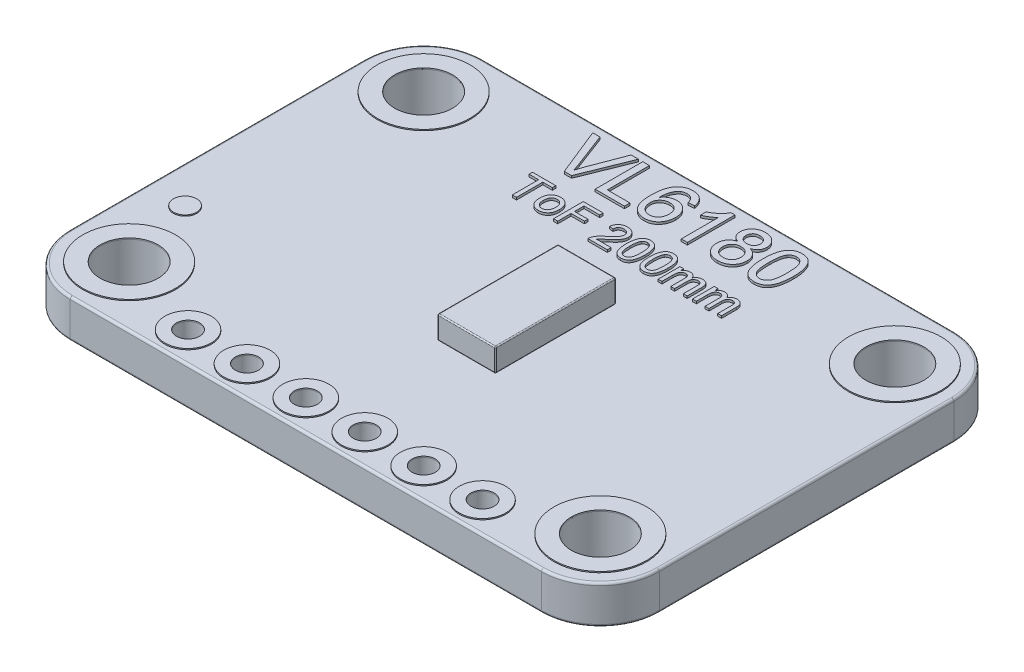
from build123d import *
from build123d.topology import SkipClean

# Parameters (mm, degrees)
SKETCH1_R               = 1.25
SKETCH1_R_2             = 0.5
BOSS_EXTRUDE1_DEPTH     = 1.65
SKETCH2_W               = 2.5
SKETCH2_H               = 5.2
BNO055_IC_DEPTH         = 1
FILLET1_R               = 0.1
FILLET2_R               = 0.05
SKETCH16_R              = 2
SKETCH16_R_2            = 1.25
BOSS_EXTRUDE10_DEPTH    = 0.05
BOSS_EXTRUDE10_2_DEPTH  = 0.05
BOSS_EXTRUDE10_3_DEPTH  = 0.05
BOSS_EXTRUDE10_4_DEPTH  = 0.05
SKETCH16_R_3            = 1
SKETCH16_R_4            = 0.5
BOSS_EXTRUDE10_5_DEPTH  = 0.05
BOSS_EXTRUDE10_6_DEPTH  = 0.05
BOSS_EXTRUDE10_7_DEPTH  = 0.05
BOSS_EXTRUDE10_8_DEPTH  = 0.05
BOSS_EXTRUDE10_9_DEPTH  = 0.05
BOSS_EXTRUDE10_10_DEPTH = 0.05
BOSS_EXTRUDE10_11_DEPTH = 0.05
BOSS_EXTRUDE14_DEPTH    = 0.1


with BuildPart() as part:
    # Sketch1 → Boss-Extrude1 (new body)
    with BuildSketch(Plane(origin=(0, 0, 0), x_dir=(1, 0, 0), z_dir=(0, 1, 0))):
        with BuildLine():
            Line((2.54, 0), (22.86, 0))
            ThreePointArc((22.86, 0), (24.656051224, 0.743948776), (25.4, 2.54))
            Line((25.4, 2.54), (25.4, 15.24))
            ThreePointArc((25.4, 15.24), (24.656051224, 17.036051224), (22.86, 17.78))
            Line((22.86, 17.78), (2.54, 17.78))
            ThreePointArc((2.54, 17.78), (0.743948776, 17.036051224), (0, 15.24))
            Line((0, 15.24), (0, 2.54))
            ThreePointArc((0, 2.54), (0.743948776, 0.743948776), (2.54, 0))
        make_face()
        with Locations(Location((2.54, 2.54, 0), (0, 0, 270))):
            Circle(SKETCH1_R, mode=Mode.SUBTRACT)
        with Locations(Location((2.54, 15.24, 0), (0, 0, 90))):
            Circle(SKETCH1_R, mode=Mode.SUBTRACT)
        with Locations(Location((22.86, 2.54, 0), (0, 0, 90))):
            Circle(SKETCH1_R, mode=Mode.SUBTRACT)
        with Locations(Location((22.86, 15.24, 0), (0, 0, 270))):
            Circle(SKETCH1_R, mode=Mode.SUBTRACT)
        with Locations(Location((19.05, 1.27, 0), (0, 0, 270))):
            Circle(SKETCH1_R_2, mode=Mode.SUBTRACT)
        with Locations(Location((16.51, 1.27, 0), (0, 0, 270))):
            Circle(SKETCH1_R_2, mode=Mode.SUBTRACT)
        with Locations(Location((13.97, 1.27, 0), (0, 0, 270))):
            Circle(SKETCH1_R_2, mode=Mode.SUBTRACT)
        with Locations(Location((11.43, 1.27, 0), (0, 0, 270))):
            Circle(SKETCH1_R_2, mode=Mode.SUBTRACT)
        with Locations(Location((8.89, 1.27, 0), (0, 0, 270))):
            Circle(SKETCH1_R_2, mode=Mode.SUBTRACT)
        with Locations(Location((6.35, 1.27, 0), (0, 0, 270))):
            Circle(SKETCH1_R_2, mode=Mode.SUBTRACT)
    extrude(amount=BOSS_EXTRUDE1_DEPTH)

    # Fillet1
    fillet1_edges = [part.edges().sort_by_distance(p)[0] for p in [
        (24.656051224, 1.65, -17.036051224),
        (25.4, 0, -8.89),
        (24.656051224, 0, -0.743948776),
        (12.7, 1.65, -17.78),
        (0.743948776, 1.65, -17.036051224),
        (0, 1.65, -8.89),
        (0.743948776, 1.65, -0.743948776),
        (12.7, 1.65, 0),
        (24.656051224, 1.65, -0.743948776),
        (25.4, 1.65, -8.89),
        (12.7, 0, 0),
        (0.743948776, 0, -0.743948776),
        (0, 0, -8.89),
        (0.743948776, 0, -17.036051224),
        (12.7, 0, -17.78),
        (24.656051224, 0, -17.036051224),
    ]]
    fillet(fillet1_edges, radius=FILLET1_R)


with BuildPart() as body_2:
    # Sketch2 → BNO055_IC (new body)
    with BuildSketch(Plane(origin=(0, 1.65, 0), x_dir=(1, 0, 0), z_dir=(0, 1, 0))):
        with Locations((13.335, 8.89)):
            Rectangle(SKETCH2_W, SKETCH2_H)
    extrude(amount=BNO055_IC_DEPTH)

    # Fillet2
    fillet2_edges = [body_2.edges().sort_by_distance(p)[0] for p in [
        (14.585, 2.65, -8.89),
        (13.335, 2.65, -11.49),
        (12.085, 2.65, -8.89),
        (13.335, 1.65, -11.49),
        (14.585, 1.65, -8.89),
        (13.335, 1.65, -6.29),
        (12.085, 1.65, -8.89),
        (13.335, 2.65, -6.29),
        (12.085, 2.15, -11.49),
        (14.585, 2.15, -11.49),
        (14.585, 2.15, -6.29),
        (12.085, 2.15, -6.29),
    ]]
    fillet(fillet2_edges, radius=FILLET2_R)


with BuildPart() as body_3:
    # Sketch16 → Boss-Extrude10 (new body)
    with BuildSketch(Plane(origin=(0, 1.65, 0), x_dir=(1, 0, 0), z_dir=(0, 1, 0))):
        with Locations(Location((2.54, 2.54, 0), (0, 0, 270))):
            Circle(SKETCH16_R)
        with Locations(Location((2.54, 2.54, 0), (0, 0, 270))):
            Circle(SKETCH16_R_2, mode=Mode.SUBTRACT)
    boss_extrude10 = extrude(amount=BOSS_EXTRUDE10_DEPTH)


with BuildPart() as body_4:
    # Sketch16 → Boss-Extrude10 2 (new body)
    with BuildSketch(Plane(origin=(0, 1.65, 0), x_dir=(1, 0, 0), z_dir=(0, 1, 0))):
        with Locations(Location((2.54, 15.24, 0), (0, 0, 270))):
            Circle(SKETCH16_R)
        with Locations(Location((2.54, 15.24, 0), (0, 0, 270))):
            Circle(SKETCH16_R_2, mode=Mode.SUBTRACT)
    boss_extrude10_2 = extrude(amount=BOSS_EXTRUDE10_2_DEPTH)


with BuildPart() as body_5:
    # Sketch16 → Boss-Extrude10 3 (new body)
    with BuildSketch(Plane(origin=(0, 1.65, 0), x_dir=(1, 0, 0), z_dir=(0, 1, 0))):
        with Locations(Location((22.86, 15.24, 0), (0, 0, 270))):
            Circle(SKETCH16_R)
        with Locations(Location((22.86, 15.24, 0), (0, 0, 270))):
            Circle(SKETCH16_R_2, mode=Mode.SUBTRACT)
    boss_extrude10_3 = extrude(amount=BOSS_EXTRUDE10_3_DEPTH)


with BuildPart() as body_6:
    # Sketch16 → Boss-Extrude10 4 (new body)
    with BuildSketch(Plane(origin=(0, 1.65, 0), x_dir=(1, 0, 0), z_dir=(0, 1, 0))):
        with Locations(Location((22.86, 2.54, 0), (0, 0, 270))):
            Circle(SKETCH16_R)
        with Locations(Location((22.86, 2.54, 0), (0, 0, 270))):
            Circle(SKETCH16_R_2, mode=Mode.SUBTRACT)
    boss_extrude10_4 = extrude(amount=BOSS_EXTRUDE10_4_DEPTH)


with BuildPart() as body_7:
    # Sketch16 → Boss-Extrude10 5 (new body)
    with BuildSketch(Plane(origin=(0, 1.65, 0), x_dir=(1, 0, 0), z_dir=(0, 1, 0))):
        with Locations(Location((19.05, 1.27, 0), (0, 0, 270))):
            Circle(SKETCH16_R_3)
        with Locations(Location((19.05, 1.27, 0), (0, 0, 270))):
            Circle(SKETCH16_R_4, mode=Mode.SUBTRACT)
    boss_extrude10_5 = extrude(amount=BOSS_EXTRUDE10_5_DEPTH)


with BuildPart() as body_8:
    # Sketch16 → Boss-Extrude10 6 (new body)
    with BuildSketch(Plane(origin=(0, 1.65, 0), x_dir=(1, 0, 0), z_dir=(0, 1, 0))):
        with Locations(Location((16.51, 1.27, 0), (0, 0, 270))):
            Circle(SKETCH16_R_3)
        with Locations(Location((16.51, 1.27, 0), (0, 0, 270))):
            Circle(SKETCH16_R_4, mode=Mode.SUBTRACT)
    boss_extrude10_6 = extrude(amount=BOSS_EXTRUDE10_6_DEPTH)


with BuildPart() as body_9:
    # Sketch16 → Boss-Extrude10 7 (new body)
    with BuildSketch(Plane(origin=(0, 1.65, 0), x_dir=(1, 0, 0), z_dir=(0, 1, 0))):
        with Locations(Location((13.97, 1.27, 0), (0, 0, 270))):
            Circle(SKETCH16_R_3)
        with Locations(Location((13.97, 1.27, 0), (0, 0, 270))):
            Circle(SKETCH16_R_4, mode=Mode.SUBTRACT)
    boss_extrude10_7 = extrude(amount=BOSS_EXTRUDE10_7_DEPTH)


with BuildPart() as body_10:
    # Sketch16 → Boss-Extrude10 8 (new body)
    with BuildSketch(Plane(origin=(0, 1.65, 0), x_dir=(1, 0, 0), z_dir=(0, 1, 0))):
        with Locations(Location((11.43, 1.27, 0), (0, 0, 270))):
            Circle(SKETCH16_R_3)
        with Locations(Location((11.43, 1.27, 0), (0, 0, 270))):
            Circle(SKETCH16_R_4, mode=Mode.SUBTRACT)
    boss_extrude10_8 = extrude(amount=BOSS_EXTRUDE10_8_DEPTH)


with BuildPart() as body_11:
    # Sketch16 → Boss-Extrude10 9 (new body)
    with BuildSketch(Plane(origin=(0, 1.65, 0), x_dir=(1, 0, 0), z_dir=(0, 1, 0))):
        with Locations(Location((8.89, 1.27, 0), (0, 0, 270))):
            Circle(SKETCH16_R_3)
        with Locations(Location((8.89, 1.27, 0), (0, 0, 270))):
            Circle(SKETCH16_R_4, mode=Mode.SUBTRACT)
    boss_extrude10_9 = extrude(amount=BOSS_EXTRUDE10_9_DEPTH)


with BuildPart() as body_12:
    # Sketch16 → Boss-Extrude10 10 (new body)
    with BuildSketch(Plane(origin=(0, 1.65, 0), x_dir=(1, 0, 0), z_dir=(0, 1, 0))):
        with Locations(Location((6.35, 1.27, 0), (0, 0, 270))):
            Circle(SKETCH16_R_3)
        with Locations(Location((6.35, 1.27, 0), (0, 0, 270))):
            Circle(SKETCH16_R_4, mode=Mode.SUBTRACT)
    boss_extrude10_10 = extrude(amount=BOSS_EXTRUDE10_10_DEPTH)


with BuildPart() as body_13:
    # Sketch16 → Boss-Extrude10 11 (new body)
    with BuildSketch(Plane(origin=(0, 1.65, 0), x_dir=(1, 0, 0), z_dir=(0, 1, 0))):
        with Locations(Location((1.651, 5.842, 0), (0, 0, 270))):
            Circle(SKETCH16_R_4)
    boss_extrude10_11 = extrude(amount=BOSS_EXTRUDE10_11_DEPTH)


with BuildPart() as part_1:
    with SkipClean():  # the faces are left unmerged after this step: merging them gives an invalid solid
        add(part.part)

        # Mirror1: Boss-Extrude10, Boss-Extrude10 2, Boss-Extrude10 3, Boss-Extrude10 4, Boss-Extrude10 5, Boss-Extrude10 6, Boss-Extrude10 7, Boss-Extrude10 8, Boss-Extrude10 9, Boss-Extrude10 10, Boss-Extrude10 11 across plane
        add(boss_extrude10.mirror(Plane.ZX.offset(0.825)))
        add(boss_extrude10_2.mirror(Plane.ZX.offset(0.825)))
        add(boss_extrude10_3.mirror(Plane.ZX.offset(0.825)))
        add(boss_extrude10_4.mirror(Plane.ZX.offset(0.825)))
        add(boss_extrude10_5.mirror(Plane.ZX.offset(0.825)))
        add(boss_extrude10_6.mirror(Plane.ZX.offset(0.825)))
        add(boss_extrude10_7.mirror(Plane.ZX.offset(0.825)))
        add(boss_extrude10_8.mirror(Plane.ZX.offset(0.825)))
        add(boss_extrude10_9.mirror(Plane.ZX.offset(0.825)))
        add(boss_extrude10_10.mirror(Plane.ZX.offset(0.825)))
        add(boss_extrude10_11.mirror(Plane.ZX.offset(0.825)))

    # Sketch22 → Boss-Extrude14 (add)
    # profile 1 of 14: a face of its own
    with SkipClean():  # the faces are left unmerged after this step: merging them gives an invalid solid
        with BuildSketch(Plane(origin=(0, 1.65, 0), x_dir=(1, 0, 0), z_dir=(0, 1, 0))):
            with BuildLine():
                Line((8.604684148, 15.24), (7.776154419, 17.294654948))
                Line((7.776154419, 17.294654948), (8.090197232, 17.294654948))
                Line((8.090197232, 17.294654948), (8.649135818, 15.821987599))
                add(Edge.make_bspline(
                    [(8.649135818, 15.821987599), (8.660073692, 15.792938604), (8.681470429, 15.736112778), (8.711308197, 15.651787148), (8.737981365, 15.570239966), (8.75406228, 15.51648443), (8.76191135, 15.490246436)],
                    knots=[0, 0, 0, 0, 1.062747156, 2.078952616, 3.062339733, 4, 4, 4, 4], degree=3))
                add(Edge.make_bspline(
                    [(8.76191135, 15.490246436), (8.778620863, 15.54573062), (8.812279464, 15.657494496), (8.852964701, 15.766896998), (8.873452113, 15.821987599)],
                    knots=[0, 0, 0, 0, 0.992882236, 2, 2, 2, 2], degree=3))
                Line((8.873452113, 15.821987599), (9.433625467, 17.294654948))
                Line((9.433625467, 17.294654948), (9.747668281, 17.294654948))
                Line((9.747668281, 17.294654948), (8.918726962, 15.24))
                Line((8.918726962, 15.24), (8.604684148, 15.24))
            make_face()
        # profile 2 of 14: a face of its own
        with BuildSketch(Plane(origin=(0, 1.65, 0), x_dir=(1, 0, 0), z_dir=(0, 1, 0))):
            Polygon((9.934118339, 15.24), (9.934118339, 17.294654948), (10.22387737, 17.294654948), (10.22387737, 15.477075571), (11.198521384, 15.477075571), (11.198521384, 15.24), align=None)
        # profile 3 of 14: a face of its own
        with BuildSketch(Plane(origin=(0, 1.65, 0), x_dir=(1, 0, 0), z_dir=(0, 1, 0))):
            with BuildLine():
                Line((12.7, 16.767820346), (12.436582699, 16.741478616))
                add(Edge.make_bspline(
                    [(12.436582699, 16.741478616), (12.430898366, 16.764133909), (12.420198483, 16.806779012), (12.397760929, 16.86462066), (12.373035222, 16.913544857), (12.351553958, 16.939889186), (12.341505517, 16.952212457)],
                    knots=[0, 0, 0, 0, 1.199207122, 2.257322842, 3.184815751, 4, 4, 4, 4], degree=3))
                add(Edge.make_bspline(
                    [(12.341505517, 16.952212457), (12.332880099, 16.960617604), (12.315915899, 16.977148582), (12.288066856, 16.998696832), (12.258709356, 17.016953589), (12.227754667, 17.03174433), (12.195370022, 17.043428167), (12.161421275, 17.051601633), (12.125985336, 17.056661472), (12.101840169, 17.057270803), (12.089612723, 17.057579377)],
                    knots=[0, 0, 0, 0, 1.028360939, 2.022547923, 3.001693811, 3.976902288, 4.948369586, 5.937776631, 6.955661634, 8, 8, 8, 8], degree=3))
                add(Edge.make_bspline(
                    [(12.089612723, 17.057579377), (12.069789929, 17.056941108), (12.030620955, 17.055679915), (11.97315307, 17.043332938), (11.917335599, 17.024853716), (11.882754613, 17.006121215), (11.865296427, 16.996664126)],
                    knots=[0, 0, 0, 0, 1.010336883, 1.996381556, 2.988474728, 4, 4, 4, 4], degree=3))
                add(Edge.make_bspline(
                    [(11.865296427, 16.996664126), (11.848127386, 16.982439131), (11.812883451, 16.95323862), (11.766889681, 16.899282193), (11.725758059, 16.836460799), (11.695422746, 16.777812242), (11.674073717, 16.725228655), (11.660266326, 16.68016292), (11.648469628, 16.630374555), (11.638642313, 16.575957371), (11.631041518, 16.516867225), (11.624688774, 16.453066588), (11.621175168, 16.384393695), (11.620392594, 16.337026751), (11.619989066, 16.312602323)],
                    knots=[0, 0, 0, 0, 1.063306303, 2.18271343, 3.369442992, 4.644240368, 5.329284104, 6.077448525, 6.892756613, 7.771869145, 8.717113863, 9.73749892, 10.833357348, 12, 12, 12, 12], degree=3))
                add(Edge.make_bspline(
                    [(11.619989066, 16.312602323), (11.635519263, 16.334421785), (11.665920571, 16.377134713), (11.719550777, 16.433006393), (11.778112485, 16.480235693), (11.841671168, 16.517945125), (11.908568384, 16.54717087), (11.977328965, 16.568201422), (12.047832403, 16.581110532), (12.09532121, 16.582651739), (12.119247169, 16.583428235)],
                    knots=[0, 0, 0, 0, 1.083917396, 2.121834425, 3.126226247, 4.123362703, 5.106535049, 6.077135049, 7.031216202, 8, 8, 8, 8], degree=3))
                add(Edge.make_bspline(
                    [(12.119247169, 16.583428235), (12.139853283, 16.582873823), (12.180564578, 16.581778476), (12.240516572, 16.573098362), (12.297992862, 16.557916243), (12.35349154, 16.538138048), (12.4059461, 16.511132959), (12.456636733, 16.479571961), (12.504389439, 16.441165848), (12.549808578, 16.398012202), (12.591160939, 16.350034945), (12.62776071, 16.298397756), (12.658260605, 16.242976863), (12.682992492, 16.184143427), (12.702349516, 16.122111532), (12.716414693, 16.056705024), (12.724648259, 15.98779463), (12.725769677, 15.940684727), (12.72634173, 15.916653192)],
                    knots=[0, 0, 0, 0, 0.981553735, 1.939246043, 2.877808487, 3.810434071, 4.740031046, 5.683044261, 6.650811044, 7.654063953, 8.664382933, 9.663624521, 10.66421212, 11.671863278, 12.699354266, 13.755775259, 14.855184124, 16, 16, 16, 16], degree=3))
                add(Edge.make_bspline(
                    [(12.72634173, 15.916653192), (12.725316814, 15.884893663), (12.723294166, 15.822216996), (12.707059247, 15.729917224), (12.680899091, 15.640949166), (12.649604922, 15.570494177), (12.620853749, 15.516518127), (12.596440641, 15.478764882), (12.570336141, 15.443286343), (12.543034718, 15.409594299), (12.512556176, 15.379230774), (12.480748299, 15.350765057), (12.446559718, 15.325181285), (12.410995955, 15.301628203), (12.373385186, 15.281205278), (12.334821783, 15.263057302), (12.294988299, 15.247598565), (12.253756113, 15.235460847), (12.211336397, 15.225419066), (12.16758796, 15.218514415), (12.122625939, 15.214256142), (12.092229076, 15.213859104), (12.076853447, 15.21365827)],
                    knots=[0, 0, 0, 0, 1.777979151, 3.508799182, 5.232661887, 6.960203328, 7.816385973, 8.656273476, 9.47551652, 10.283326439, 11.082130802, 11.882412381, 12.672407567, 13.471692325, 14.269609044, 15.067192643, 15.857822979, 16.66013129, 17.472860815, 18.297850482, 19.139002666, 20, 20, 20, 20], degree=3))
                add(Edge.make_bspline(
                    [(12.076853447, 15.21365827), (12.050886887, 15.214378337), (11.999961897, 15.215790514), (11.925425725, 15.226639498), (11.854650369, 15.244769676), (11.787485279, 15.270117714), (11.72372585, 15.302119091), (11.664000416, 15.342235024), (11.6079785, 15.389276013), (11.555616914, 15.443514877), (11.508140709, 15.506144453), (11.467565406, 15.578438201), (11.432991645, 15.659763301), (11.404696032, 15.750343505), (11.383284421, 15.850273538), (11.367867158, 15.959338779), (11.358385712, 16.077554851), (11.357190549, 16.159472582), (11.356571765, 16.201884738)],
                    knots=[0, 0, 0, 0, 0.898506621, 1.76212948, 2.600594211, 3.422599815, 4.24233914, 5.064166416, 5.906856258, 6.769969817, 7.668413694, 8.619051846, 9.63165591, 10.722000005, 11.898403521, 13.164960021, 14.532183992, 16, 16, 16, 16], degree=3))
                add(Edge.make_bspline(
                    [(11.356571765, 16.201884738), (11.356674368, 16.226035587), (11.356876736, 16.273669317), (11.360128617, 16.343774293), (11.363858926, 16.411477594), (11.370250221, 16.476509114), (11.377796663, 16.539161342), (11.387923888, 16.599065839), (11.398799308, 16.656688226), (11.412021599, 16.711574828), (11.426761221, 16.764241985), (11.443727039, 16.814110997), (11.461647146, 16.861827084), (11.481977134, 16.906637524), (11.503644165, 16.949272126), (11.527593896, 16.988941926), (11.552710657, 17.026553984), (11.571252894, 17.04974676), (11.580476471, 17.061283683)],
                    knots=[0, 0, 0, 0, 1.28053818, 2.525659045, 3.721026795, 4.875695215, 5.990149104, 7.066600796, 8.096771069, 9.099076143, 10.059445332, 10.995815448, 11.891625124, 12.761078582, 13.603822678, 14.426062074, 15.217066536, 16, 16, 16, 16], degree=3))
                add(Edge.make_bspline(
                    [(11.580476471, 17.061283683), (11.59706952, 17.079947595), (11.629775961, 17.116735898), (11.685726398, 17.164257672), (11.745346303, 17.204848578), (11.809586539, 17.237642517), (11.877956116, 17.263209724), (11.950497895, 17.28176925), (12.027414301, 17.292532495), (12.079974979, 17.293935996), (12.106899483, 17.294654948)],
                    knots=[0, 0, 0, 0, 1.005002357, 1.980952959, 2.948226316, 3.90482984, 4.879026092, 5.883055346, 6.915583142, 8, 8, 8, 8], degree=3))
                add(Edge.make_bspline(
                    [(12.106899483, 17.294654948), (12.126947766, 17.294300556), (12.166334232, 17.293604325), (12.224045458, 17.286923918), (12.278938975, 17.275758619), (12.331137045, 17.260697878), (12.380336151, 17.240650109), (12.427103499, 17.216891333), (12.470964204, 17.188311019), (12.511600738, 17.155299637), (12.549113756, 17.11879297), (12.582713644, 17.078484453), (12.612273801, 17.034876469), (12.638025389, 16.987878323), (12.659738297, 16.937712489), (12.677565673, 16.884163359), (12.691115669, 16.827244696), (12.696997507, 16.787903031), (12.7, 16.767820346)],
                    knots=[0, 0, 0, 0, 1.095988384, 2.15315746, 3.171326302, 4.156539379, 5.119213808, 6.072133135, 7.021027441, 7.975952916, 8.930907862, 9.879001051, 10.840359051, 11.807350428, 12.805278655, 13.825435679, 14.889953203, 16, 16, 16, 16], degree=3))
            make_face()
            with BuildLine():
                add(Edge.make_bspline(
                    [(11.619989066, 15.922003856), (11.620721751, 15.901378401), (11.622177501, 15.860398265), (11.633312334, 15.799570282), (11.651496303, 15.740221494), (11.676417639, 15.683011026), (11.7071909, 15.629856699), (11.74374236, 15.582758296), (11.785278635, 15.542407341), (11.831576498, 15.508716271), (11.882527276, 15.482825613), (11.937218428, 15.464074045), (11.995715296, 15.452740536), (12.036055164, 15.451412842), (12.05668556, 15.450733841)],
                    knots=[0, 0, 0, 0, 1.034121613, 2.054667162, 3.090870403, 4.141799978, 5.178094622, 6.163726224, 7.122467907, 8.07367165, 9.024701118, 9.977919151, 10.965878387, 12, 12, 12, 12], degree=3))
                add(Edge.make_bspline(
                    [(12.05668556, 15.450733841), (12.071387063, 15.451131443), (12.100083097, 15.451907526), (12.142098751, 15.457921392), (12.182186327, 15.46716893), (12.220113708, 15.480832105), (12.255829422, 15.498270073), (12.289518915, 15.519493225), (12.321160402, 15.544565102), (12.350371312, 15.57343968), (12.376771654, 15.605553402), (12.399710051, 15.6407092), (12.419966798, 15.67832867), (12.435203106, 15.719336297), (12.447618491, 15.762681505), (12.45674617, 15.808774136), (12.462105078, 15.857667114), (12.462647357, 15.891258296), (12.462924429, 15.908421401)],
                    knots=[0, 0, 0, 0, 1.023436885, 1.997658284, 2.950132304, 3.883974581, 4.798406504, 5.712938251, 6.651509614, 7.604127386, 8.56812849, 9.540661787, 10.523651728, 11.536824179, 12.580180944, 13.661349568, 14.805088061, 16, 16, 16, 16], degree=3))
                add(Edge.make_bspline(
                    [(12.462924429, 15.908421401), (12.462667448, 15.924902882), (12.46216489, 15.957134497), (12.456510068, 16.004167273), (12.448272348, 16.048629922), (12.435626491, 16.090148319), (12.420105867, 16.129162006), (12.400658694, 16.16537915), (12.377999063, 16.199107563), (12.351431578, 16.229454133), (12.322378133, 16.257101642), (12.290469761, 16.281116143), (12.256089404, 16.301397692), (12.219113037, 16.318001557), (12.179471006, 16.330726466), (12.137245399, 16.339545139), (12.092673809, 16.345700958), (12.062058282, 16.346132099), (12.046395822, 16.346352664)],
                    knots=[0, 0, 0, 0, 1.155658139, 2.260035327, 3.319019312, 4.323913291, 5.299809325, 6.260058621, 7.202437855, 8.144128683, 9.083751266, 10.011616631, 10.939332216, 11.87851101, 12.849505762, 13.853846437, 14.90205895, 16, 16, 16, 16], degree=3))
                add(Edge.make_bspline(
                    [(12.046395822, 16.346352664), (12.031829712, 16.346125079), (12.003125808, 16.345676602), (11.96103129, 16.33947275), (11.920460722, 16.330636404), (11.881576086, 16.317780765), (11.844364006, 16.30122515), (11.808832735, 16.28108721), (11.775290825, 16.256790053), (11.743432432, 16.229580032), (11.714362033, 16.199353452), (11.688857013, 16.166651887), (11.668054052, 16.13126495), (11.649868887, 16.094058352), (11.63654525, 16.054155024), (11.627065314, 16.012089946), (11.621187996, 15.967855354), (11.620394927, 15.93752548), (11.619989066, 15.922003856)],
                    knots=[0, 0, 0, 0, 1.036988316, 2.04348404, 3.025371103, 3.992992706, 4.955812186, 5.923433788, 6.897355974, 7.902569022, 8.905116476, 9.880852345, 10.849905012, 11.825004025, 12.826645469, 13.839294292, 14.894236693, 16, 16, 16, 16], degree=3))
            make_face(mode=Mode.SUBTRACT)
        # profile 4 of 14: a face of its own
        with BuildSketch(Plane(origin=(0, 1.65, 0), x_dir=(1, 0, 0), z_dir=(0, 1, 0))):
            with BuildLine():
                Line((13.911719585, 15.24), (13.648302284, 15.24))
                Line((13.648302284, 15.24), (13.648302284, 16.841083283))
                add(Edge.make_bspline(
                    [(13.648302284, 16.841083283), (13.633134692, 16.826456007), (13.601610515, 16.796054817), (13.548322225, 16.753029542), (13.488845683, 16.709421601), (13.423953229, 16.667487692), (13.357806351, 16.628011438), (13.293883909, 16.592508617), (13.233253116, 16.562464616), (13.193315285, 16.546036438), (13.174151142, 16.538153387)],
                    knots=[0, 0, 0, 0, 0.893362401, 1.856755847, 2.901947673, 4.020460078, 5.132200827, 6.168787962, 7.121294059, 8, 8, 8, 8], degree=3))
                Line((13.174151142, 16.538153387), (13.174151142, 16.780991211))
                add(Edge.make_bspline(
                    [(13.174151142, 16.780991211), (13.207067538, 16.797943221), (13.271943805, 16.831354628), (13.363599942, 16.889060722), (13.449170805, 16.951616503), (13.527239858, 17.019008122), (13.59722379, 17.087894454), (13.656200265, 17.157403469), (13.705548027, 17.224987266), (13.730306734, 17.27211947), (13.742144697, 17.294654948)],
                    knots=[0, 0, 0, 0, 1.141258006, 2.249351951, 3.335817539, 4.406819942, 5.426913362, 6.360259544, 7.215985427, 8, 8, 8, 8], degree=3))
                Line((13.742144697, 17.294654948), (13.911719585, 17.294654948))
                Line((13.911719585, 17.294654948), (13.911719585, 15.24))
            make_face()
        # profile 5 of 14: a face of its own
        with BuildSketch(Plane(origin=(0, 1.65, 0), x_dir=(1, 0, 0), z_dir=(0, 1, 0))):
            with BuildLine():
                add(Edge.make_bspline(
                    [(14.960449714, 16.366932141), (14.935456064, 16.376709798), (14.887534948, 16.39545681), (14.822901717, 16.432974858), (14.768200019, 16.476134431), (14.724101517, 16.525976295), (14.690490441, 16.581470081), (14.666289138, 16.641908246), (14.65211401, 16.707627497), (14.650248399, 16.753070666), (14.649288028, 16.776463726)],
                    knots=[0, 0, 0, 0, 1.16287356, 2.229614231, 3.228817875, 4.173350329, 5.100165549, 6.029633206, 6.985702163, 8, 8, 8, 8], degree=3))
                add(Edge.make_bspline(
                    [(14.649288028, 16.776463726), (14.64974003, 16.794463654), (14.650627325, 16.829798076), (14.658293752, 16.881645357), (14.670572641, 16.931328024), (14.687999258, 16.978705852), (14.709831952, 17.024168804), (14.73738113, 17.066883979), (14.769047199, 17.108058594), (14.806142494, 17.146028245), (14.847020867, 17.180804771), (14.891298526, 17.211752463), (14.939314282, 17.237060152), (14.990267576, 17.258219512), (15.044410347, 17.274785054), (15.101933316, 17.286067111), (15.1626337, 17.293243336), (15.204227046, 17.294177082), (15.225513373, 17.294654948)],
                    knots=[0, 0, 0, 0, 0.994101948, 1.951453197, 2.889123786, 3.817215529, 4.736003873, 5.669743943, 6.620499649, 7.601567446, 8.596478358, 9.582687259, 10.579761808, 11.589151689, 12.62747492, 13.702346593, 14.8241243, 16, 16, 16, 16], degree=3))
                add(Edge.make_bspline(
                    [(15.225513373, 17.294654948), (15.24693534, 17.29417223), (15.288662913, 17.293231951), (15.349685787, 17.286152147), (15.407571763, 17.274285953), (15.462286761, 17.257450812), (15.51391704, 17.235926071), (15.56212334, 17.209469337), (15.607401914, 17.178516969), (15.648595458, 17.142699846), (15.686076673, 17.103814099), (15.718550605, 17.062154302), (15.746402463, 17.018692557), (15.769417839, 16.973164826), (15.786444701, 16.925052669), (15.799422992, 16.875262542), (15.806951003, 16.82320284), (15.807860725, 16.787874913), (15.808324152, 16.769878294)],
                    knots=[0, 0, 0, 0, 1.171211919, 2.281388661, 3.353996503, 4.398126828, 5.406889753, 6.407389155, 7.400009931, 8.40008733, 9.387021643, 10.349004252, 11.283445052, 12.206096336, 13.131640667, 14.068727932, 15.016178647, 16, 16, 16, 16], degree=3))
                add(Edge.make_bspline(
                    [(15.808324152, 16.769878294), (15.807571329, 16.747291492), (15.806095184, 16.703003021), (15.791052609, 16.639160824), (15.767607469, 16.579560932), (15.733722167, 16.525339218), (15.690807692, 16.475935691), (15.637554251, 16.432988663), (15.574770594, 16.39552925), (15.528059411, 16.37672111), (15.503747898, 16.366932141)],
                    knots=[0, 0, 0, 0, 0.998680737, 1.958225066, 2.887911823, 3.823713378, 4.77537694, 5.772726054, 6.840782926, 8, 8, 8, 8], degree=3))
                add(Edge.make_bspline(
                    [(15.503747898, 16.366932141), (15.519086885, 16.361725282), (15.549144644, 16.351522097), (15.591637348, 16.331683961), (15.631642951, 16.310293741), (15.66938705, 16.287138815), (15.703476417, 16.260497207), (15.735048373, 16.231944123), (15.763970176, 16.201077196), (15.789846785, 16.167633898), (15.812949327, 16.132316148), (15.832726936, 16.095037839), (15.849523679, 16.056329578), (15.863878755, 16.016011869), (15.874364003, 15.973800718), (15.88170039, 15.929890109), (15.886355121, 15.884511464), (15.887014489, 15.853691279), (15.887349342, 15.838039591)],
                    knots=[0, 0, 0, 0, 1.104208047, 2.163768705, 3.193778962, 4.198696312, 5.179575955, 6.14024585, 7.100368562, 8.060719304, 9.021161243, 9.975749006, 10.935506756, 11.897452199, 12.89163552, 13.897859372, 14.932451246, 16, 16, 16, 16], degree=3))
                add(Edge.make_bspline(
                    [(15.887349342, 15.838039591), (15.886825857, 15.816467325), (15.88579455, 15.773968317), (15.876733166, 15.711584761), (15.86302289, 15.651656843), (15.843031725, 15.594437721), (15.817498041, 15.539886945), (15.785912564, 15.488083731), (15.748585634, 15.439081366), (15.70661833, 15.392727536), (15.659698908, 15.350825681), (15.608940785, 15.313900901), (15.55415351, 15.28297169), (15.496001839, 15.257362415), (15.434207323, 15.237515321), (15.368849394, 15.223618147), (15.2999498, 15.215342992), (15.252838392, 15.214227368), (15.22880609, 15.21365827)],
                    knots=[0, 0, 0, 0, 1.017598406, 2.004746413, 2.969099523, 3.915171376, 4.859468899, 5.806714415, 6.772805022, 7.762836953, 8.753334612, 9.736396794, 10.719437652, 11.716790048, 12.730404696, 13.776887535, 14.865953843, 16, 16, 16, 16], degree=3))
                add(Edge.make_bspline(
                    [(15.22880609, 15.21365827), (15.204776191, 15.214239633), (15.157669495, 15.2153793), (15.088706952, 15.223485282), (15.023442533, 15.238012452), (14.961728365, 15.25787972), (14.903229668, 15.282795621), (14.848810341, 15.314421746), (14.797720667, 15.351299744), (14.750768621, 15.393460774), (14.708452716, 15.43980966), (14.671617837, 15.489535714), (14.640219867, 15.541873668), (14.614380019, 15.597118564), (14.594684163, 15.655270905), (14.580861377, 15.716112366), (14.571783591, 15.779596456), (14.570776898, 15.822915859), (14.570262837, 15.845036613)],
                    knots=[0, 0, 0, 0, 1.127066097, 2.209429196, 3.250843736, 4.258219581, 5.246860502, 6.227045772, 7.204057202, 8.19754525, 9.181483529, 10.142920909, 11.095356922, 12.039670968, 12.998174893, 13.969127444, 14.962948905, 16, 16, 16, 16], degree=3))
                add(Edge.make_bspline(
                    [(14.570262837, 15.845036613), (14.570620148, 15.861507161), (14.571321255, 15.893825226), (14.575604075, 15.941227034), (14.584139653, 15.986405938), (14.595134022, 16.02962818), (14.609093431, 16.071001888), (14.626315018, 16.110202155), (14.64720924, 16.147134238), (14.670946447, 16.182038452), (14.697826174, 16.214669758), (14.727412764, 16.244742395), (14.759813688, 16.271914309), (14.79430084, 16.296979107), (14.832319798, 16.31816378), (14.872456649, 16.337604664), (14.915401453, 16.354184133), (14.945283241, 16.362640248), (14.960449714, 16.366932141)],
                    knots=[0, 0, 0, 0, 1.117345089, 2.192424383, 3.22371675, 4.232639188, 5.215561493, 6.182180952, 7.132172269, 8.089790513, 9.041830748, 9.996006267, 10.94686322, 11.907506267, 12.882866327, 13.894317773, 14.931262935, 16, 16, 16, 16], degree=3))
            make_face()
            with BuildLine():
                add(Edge.make_bspline(
                    [(14.912705329, 16.775228957), (14.913487148, 16.754259094), (14.91499797, 16.713736014), (14.931428324, 16.656175947), (14.957120628, 16.604470866), (14.987240347, 16.566975538), (15.016117592, 16.541428032), (15.040219631, 16.52437087), (15.066558498, 16.509889683), (15.095325006, 16.498633992), (15.12582243, 16.48866215), (15.159102582, 16.483088616), (15.194383233, 16.478557663), (15.21877357, 16.478229517), (15.231275627, 16.478061315)],
                    knots=[0, 0, 0, 0, 1.528727296, 2.954179336, 4.335216052, 5.725683216, 6.435919001, 7.148062981, 7.879427438, 8.626027458, 9.402978632, 10.2190538, 11.08711833, 12, 12, 12, 12], degree=3))
                add(Edge.make_bspline(
                    [(15.231275627, 16.478061315), (15.243501713, 16.478235732), (15.267341912, 16.478575837), (15.301827958, 16.483014417), (15.334417152, 16.488942557), (15.36462792, 16.497925744), (15.392809044, 16.509606505), (15.418502172, 16.524006001), (15.442476163, 16.540555154), (15.470505103, 16.566297842), (15.500583256, 16.602479936), (15.526361662, 16.651875277), (15.542425667, 16.705916714), (15.54406527, 16.743559725), (15.544906851, 16.762881271)],
                    knots=[0, 0, 0, 0, 0.922112375, 1.798068639, 2.620552757, 3.419964248, 4.17189205, 4.918165909, 5.639229138, 6.36503528, 7.785020832, 9.165298717, 10.544993853, 12, 12, 12, 12], degree=3))
                add(Edge.make_bspline(
                    [(15.544906851, 16.762881271), (15.543892864, 16.782878245), (15.541908753, 16.822007143), (15.525883987, 16.87817844), (15.498904891, 16.929052859), (15.468085013, 16.966205727), (15.439560243, 16.993120792), (15.415155848, 17.010254034), (15.388921032, 17.024835938), (15.360755947, 17.036744026), (15.330619862, 17.046348023), (15.298431144, 17.052648708), (15.264325049, 17.0570676), (15.240894866, 17.057405195), (15.22880609, 17.057579377)],
                    knots=[0, 0, 0, 0, 1.480633456, 2.897216237, 4.289382554, 5.720567045, 6.454675042, 7.191244726, 7.924224627, 8.676083236, 9.454506446, 10.26432127, 11.104478565, 12, 12, 12, 12], degree=3))
                add(Edge.make_bspline(
                    [(15.22880609, 17.057579377), (15.216715968, 17.057410828), (15.193146867, 17.057082251), (15.158818376, 17.052530757), (15.126324606, 17.046814173), (15.095965332, 17.037640114), (15.067866747, 17.025651751), (15.041735362, 17.011061656), (15.017377208, 16.994366056), (14.988652031, 16.968651177), (14.958567142, 16.932468264), (14.932063201, 16.883861824), (14.915682907, 16.830864401), (14.913710148, 16.794003807), (14.912705329, 16.775228957)],
                    knots=[0, 0, 0, 0, 0.914830409, 1.783417199, 2.618873138, 3.411020283, 4.179090249, 4.927874451, 5.674348476, 6.410336976, 7.841713217, 9.213201474, 10.580551314, 12, 12, 12, 12], degree=3))
            make_face(mode=Mode.SUBTRACT)
            with BuildLine():
                add(Edge.make_bspline(
                    [(14.833680138, 15.849975688), (14.834135646, 15.833073391), (14.835047862, 15.799224274), (14.843049958, 15.748951162), (14.856627857, 15.699614228), (14.874030298, 15.651166869), (14.898577523, 15.605564504), (14.931129905, 15.564861039), (14.971977047, 15.53064002), (15.018626716, 15.501728804), (15.0695335, 15.478973191), (15.122579857, 15.463088999), (15.176396689, 15.452593519), (15.212706178, 15.451353804), (15.230864037, 15.450733841)],
                    knots=[0, 0, 0, 0, 0.957879255, 1.91828174, 2.876792425, 3.856375228, 4.831004356, 5.799187063, 6.79220414, 7.836856316, 8.902268238, 9.943090861, 10.971368942, 12, 12, 12, 12], degree=3))
                add(Edge.make_bspline(
                    [(15.230864037, 15.450733841), (15.245837151, 15.450987474), (15.274925642, 15.451480212), (15.317327554, 15.457110798), (15.357279742, 15.465654239), (15.394965245, 15.477368696), (15.429829373, 15.49339485), (15.462439875, 15.512125942), (15.492463188, 15.5347639), (15.519890812, 15.560599525), (15.544443397, 15.589178569), (15.565475792, 15.620009112), (15.583822598, 15.652224121), (15.598801926, 15.686518847), (15.609634395, 15.722964007), (15.617993174, 15.760902052), (15.623035779, 15.800724292), (15.623628957, 15.827872527), (15.623932041, 15.841743897)],
                    knots=[0, 0, 0, 0, 1.149387474, 2.232932207, 3.278773642, 4.285224938, 5.256757121, 6.220082341, 7.168479488, 8.137608443, 9.109140627, 10.056190326, 10.999892409, 11.953252726, 12.923240661, 13.915357002, 14.934853301, 16, 16, 16, 16], degree=3))
                add(Edge.make_bspline(
                    [(15.623932041, 15.841743897), (15.623619305, 15.855887545), (15.623007016, 15.883578555), (15.618092561, 15.924274811), (15.609265074, 15.96288032), (15.59791289, 15.999978298), (15.582527435, 16.034923346), (15.56405935, 16.068216536), (15.541443448, 16.098980332), (15.516643309, 16.128259171), (15.488577855, 16.154763287), (15.45758481, 16.177618789), (15.424646413, 16.197804067), (15.388766249, 16.213287879), (15.350734804, 16.225690766), (15.3103714, 16.234702893), (15.267511461, 16.240211766), (15.238152594, 16.240722769), (15.223043836, 16.240985744)],
                    knots=[0, 0, 0, 0, 1.065858887, 2.086781919, 3.082735321, 4.047496077, 5.006086125, 5.955204095, 6.910833714, 7.878747924, 8.844339535, 9.812198509, 10.776903849, 11.749116737, 12.749729282, 13.788304076, 14.861809717, 16, 16, 16, 16], degree=3))
                add(Edge.make_bspline(
                    [(15.223043836, 16.240985744), (15.208345367, 16.240720152), (15.17953179, 16.24019951), (15.137673628, 16.234659432), (15.098046808, 16.22615171), (15.060999969, 16.213699525), (15.026069912, 16.198139255), (14.993895495, 16.178573329), (14.963902728, 16.155862871), (14.937007784, 16.129466284), (14.912741575, 16.100792414), (14.891760839, 16.070054113), (14.873226484, 16.037964418), (14.859161154, 16.00347035), (14.847256111, 15.967687037), (14.839813576, 15.929919966), (14.834522864, 15.890598235), (14.833965153, 15.863714449), (14.833680138, 15.849975688)],
                    knots=[0, 0, 0, 0, 1.135239447, 2.225422834, 3.256957183, 4.262780498, 5.240265059, 6.205773948, 7.16638056, 8.141101257, 9.111719309, 10.064571387, 11.014055337, 11.969087385, 12.938082716, 13.92369833, 14.938921288, 16, 16, 16, 16], degree=3))
            make_face(mode=Mode.SUBTRACT)
        # profile 6 of 14: a face of its own
        with BuildSketch(Plane(origin=(0, 1.65, 0), x_dir=(1, 0, 0), z_dir=(0, 1, 0))):
            with BuildLine():
                add(Edge.make_bspline(
                    [(16.150766643, 16.25333343), (16.151032036, 16.282696335), (16.151551829, 16.340205901), (16.154775937, 16.424352728), (16.160404968, 16.504263485), (16.168807562, 16.579868774), (16.178757807, 16.65133925), (16.191693188, 16.718572918), (16.206247372, 16.781720628), (16.223709781, 16.840716558), (16.242895253, 16.896067965), (16.264661782, 16.947686055), (16.28915208, 16.995516098), (16.315162601, 17.04005412), (16.344062593, 17.080607372), (16.374107709, 17.118313943), (16.407481449, 17.151790986), (16.442796061, 17.181899869), (16.480571563, 17.208469203), (16.520608084, 17.231395334), (16.562751575, 17.251637455), (16.607805244, 17.266875718), (16.654833786, 17.279298133), (16.704199202, 17.288436212), (16.755955891, 17.293823417), (16.791324313, 17.29437464), (16.809309896, 17.294654948)],
                    knots=[0, 0, 0, 0, 1.514747001, 2.966751498, 4.343369068, 5.64627492, 6.890416844, 8.064737671, 9.177176366, 10.232018008, 11.237056675, 12.19799043, 13.119080079, 14.007588942, 14.855863561, 15.685992447, 16.491747269, 17.290132607, 18.077525251, 18.870243746, 19.668095604, 20.485086593, 21.319398728, 22.175900658, 23.072407314, 24, 24, 24, 24], degree=3))
                add(Edge.make_bspline(
                    [(16.809309896, 17.294654948), (16.835697085, 17.293879183), (16.887535776, 17.292355162), (16.963220534, 17.279925525), (17.034548539, 17.258662714), (17.101473452, 17.229978266), (17.162851201, 17.193543495), (17.217664118, 17.149251481), (17.265320957, 17.097567279), (17.305301617, 17.03787845), (17.340248705, 16.971831611), (17.37129493, 16.899130317), (17.399359816, 16.81985604), (17.41927527, 16.748894496), (17.433480948, 16.687637972), (17.442883977, 16.637115325), (17.450690377, 16.582601104), (17.456671134, 16.524227193), (17.461578204, 16.462059066), (17.465367709, 16.396058014), (17.467291271, 16.326059078), (17.467662345, 16.27802977), (17.467853148, 16.25333343)],
                    knots=[0, 0, 0, 0, 1.134486744, 2.228744715, 3.287356444, 4.328707449, 5.352829806, 6.347195599, 7.349461267, 8.364207941, 9.428085653, 10.559314403, 11.761222316, 13.04268526, 13.726896727, 14.465273606, 15.252205015, 16.094778733, 16.988606776, 17.934225168, 18.937792761, 20, 20, 20, 20], degree=3))
                add(Edge.make_bspline(
                    [(17.467853148, 16.25333343), (17.467582784, 16.224108446), (17.467054574, 16.167011689), (17.463916858, 16.083539578), (17.457948639, 16.004231709), (17.450604636, 15.92890641), (17.439494697, 15.857764764), (17.427523137, 15.79050451), (17.412717273, 15.727431068), (17.395442307, 15.668516795), (17.375986772, 15.613450173), (17.354650767, 15.56181504), (17.331019093, 15.513646677), (17.304388383, 15.469414897), (17.27597711, 15.428532594), (17.245577194, 15.390846412), (17.212544121, 15.356898762), (17.176911269, 15.326880189), (17.139400998, 15.299839686), (17.099267141, 15.276687205), (17.056685356, 15.257505776), (17.011940149, 15.241106608), (16.964577516, 15.229090259), (16.914970953, 15.219891932), (16.862937683, 15.214475291), (16.827432459, 15.213934368), (16.809309896, 15.21365827)],
                    knots=[0, 0, 0, 0, 1.508974709, 2.94807912, 4.311757619, 5.615040294, 6.854280449, 8.028314546, 9.141715822, 10.197470207, 11.196696834, 12.155719058, 13.080757287, 13.963948316, 14.818758719, 15.649605906, 16.461113142, 17.260189315, 18.052359509, 18.845763934, 19.647754795, 20.461145776, 21.303032214, 22.167241874, 23.064524267, 24, 24, 24, 24], degree=3))
                add(Edge.make_bspline(
                    [(16.809309896, 15.21365827), (16.785549114, 15.214336047), (16.739222129, 15.215657527), (16.671564983, 15.224636168), (16.608065143, 15.240438997), (16.548187024, 15.261632819), (16.492603673, 15.289980776), (16.4410497, 15.324471601), (16.392489166, 15.36430283), (16.36453477, 15.395728755), (16.350387567, 15.411632835)],
                    knots=[0, 0, 0, 0, 1.10322584, 2.150986741, 3.161425019, 4.136713905, 5.093944212, 6.049774532, 7.013026876, 8, 8, 8, 8], degree=3))
                add(Edge.make_bspline(
                    [(16.350387567, 15.411632835), (16.33410381, 15.435122393), (16.300526006, 15.483558868), (16.261226098, 15.56614755), (16.226169884, 15.657066094), (16.198657184, 15.75809831), (16.177107881, 15.868440095), (16.161543904, 15.988307965), (16.152736226, 16.117650132), (16.151437991, 16.207084674), (16.150766643, 16.25333343)],
                    knots=[0, 0, 0, 0, 0.779365345, 1.607084704, 2.489375761, 3.438383567, 4.461919411, 5.557722155, 6.737039282, 8, 8, 8, 8], degree=3))
            make_face()
            with BuildLine():
                add(Edge.make_bspline(
                    [(16.414183944, 16.254156609), (16.414445497, 16.214638121), (16.414946166, 16.138990994), (16.420176944, 16.030916022), (16.429181513, 15.933417645), (16.441086141, 15.846630855), (16.45680507, 15.770438257), (16.476542045, 15.705034013), (16.49879031, 15.649633124), (16.526322117, 15.60492224), (16.556466404, 15.568476348), (16.58758832, 15.537131701), (16.620420056, 15.51048947), (16.65474739, 15.488275282), (16.691102935, 15.471456158), (16.729089148, 15.45926562), (16.768714295, 15.452250153), (16.79570082, 15.451242162), (16.809309896, 15.450733841)],
                    knots=[0, 0, 0, 0, 1.89448813, 3.626469325, 5.185477471, 6.587276848, 7.82441448, 8.910550357, 9.859733512, 10.6775885, 11.416198291, 12.123144072, 12.791880183, 13.439617036, 14.078171869, 14.70637855, 15.347637704, 16, 16, 16, 16], degree=3))
                add(Edge.make_bspline(
                    [(16.809309896, 15.450733841), (16.822915563, 15.451253269), (16.849895331, 15.452283284), (16.889612036, 15.459144054), (16.927450453, 15.471962153), (16.963751792, 15.488721871), (16.998328627, 15.510429731), (17.030999117, 15.537172596), (17.062284977, 15.568498631), (17.092293857, 15.605368141), (17.119615909, 15.650285738), (17.142281524, 15.705641498), (17.16171091, 15.771160284), (17.177516092, 15.847314062), (17.189469828, 15.933963635), (17.198419954, 16.031191596), (17.203685738, 16.139127511), (17.204178145, 16.214637943), (17.204435847, 16.254156609)],
                    knots=[0, 0, 0, 0, 0.652509534, 1.29391342, 1.924290653, 2.562989607, 3.207355802, 3.876242846, 4.583348185, 5.32723334, 6.150888545, 7.094226006, 8.186903555, 9.424320409, 10.81992305, 12.379283064, 14.105084285, 16, 16, 16, 16], degree=3))
                add(Edge.make_bspline(
                    [(17.204435847, 16.254156609), (17.204186396, 16.29285302), (17.203708456, 16.366993878), (17.198306861, 16.472986783), (17.189842075, 16.56884869), (17.178263594, 16.654667974), (17.162875794, 16.730351467), (17.144212492, 16.796060288), (17.121972376, 16.851654304), (17.095528959, 16.897691956), (17.066092144, 16.93545532), (17.0353426, 16.968142798), (17.002511586, 16.995942433), (16.967017435, 17.01824371), (16.930004189, 17.036235551), (16.890621379, 17.048617994), (16.849256107, 17.05622538), (16.820867657, 17.057122888), (16.806428769, 17.057579377)],
                    knots=[0, 0, 0, 0, 1.850066095, 3.544656626, 5.0727657, 6.45041401, 7.682899467, 8.762389858, 9.712573485, 10.538438529, 11.291566246, 11.996865408, 12.681389046, 13.341983376, 13.996294293, 14.643563182, 15.31009126, 16, 16, 16, 16], degree=3))
                add(Edge.make_bspline(
                    [(16.806428769, 17.057579377), (16.792820548, 17.057222215), (16.765986881, 17.056517937), (16.726698878, 17.049795612), (16.689466098, 17.038554386), (16.653861976, 17.023327055), (16.620775348, 17.002834074), (16.588894082, 16.97890706), (16.559711372, 16.949754665), (16.542126127, 16.92796079), (16.533133319, 16.916815757)],
                    knots=[0, 0, 0, 0, 1.021318143, 2.013908504, 2.982026795, 3.937174072, 4.91255697, 5.897578595, 6.924855925, 8, 8, 8, 8], degree=3))
                add(Edge.make_bspline(
                    [(16.533133319, 16.916815757), (16.523342895, 16.900447155), (16.50266758, 16.865880115), (16.479533105, 16.805801176), (16.459097024, 16.737142384), (16.442271354, 16.658847374), (16.430099163, 16.571050453), (16.420489688, 16.473853581), (16.415497923, 16.36712106), (16.414634022, 16.292850334), (16.414183944, 16.254156609)],
                    knots=[0, 0, 0, 0, 0.671104906, 1.417232262, 2.260109084, 3.195198885, 4.23592645, 5.382417421, 6.636286093, 8, 8, 8, 8], degree=3))
            make_face(mode=Mode.SUBTRACT)
        # profile 7 of 14: a face of its own
        with BuildSketch(Plane(origin=(0, 1.65, 0), x_dir=(1, 0, 0), z_dir=(0, 1, 0))):
            Polygon((8.361846324, 13.24), (8.361846324, 14.375987111), (7.950256791, 14.375987111), (7.950256791, 14.524159342), (8.954535251, 14.524159342), (8.954535251, 14.375987111), (8.542945718, 14.375987111), (8.542945718, 13.24), align=None)
        # profile 8 of 14: a face of its own
        with BuildSketch(Plane(origin=(0, 1.65, 0), x_dir=(1, 0, 0), z_dir=(0, 1, 0))):
            with BuildLine():
                add(Edge.make_bspline(
                    [(9.06978032, 13.709212067), (9.070241332, 13.730064943), (9.071133423, 13.770416782), (9.077521585, 13.828970406), (9.088473625, 13.883331243), (9.103843311, 13.93355035), (9.12371936, 13.97964355), (9.148273707, 14.021352231), (9.176829148, 14.059442654), (9.199618017, 14.080973058), (9.211006979, 14.09173309)],
                    knots=[0, 0, 0, 0, 1.189940866, 2.302622481, 3.356378305, 4.350088409, 5.294652018, 6.213657312, 7.107257627, 8, 8, 8, 8], degree=3))
                add(Edge.make_bspline(
                    [(9.211006979, 14.09173309), (9.220968128, 14.100002273), (9.240708672, 14.116389756), (9.272928906, 14.13717164), (9.306473757, 14.155026845), (9.341639636, 14.169831536), (9.378537684, 14.181142855), (9.417053003, 14.188993416), (9.457136363, 14.19412237), (9.484440561, 14.19462944), (9.498347921, 14.194887716)],
                    knots=[0, 0, 0, 0, 0.994414631, 1.970684744, 2.940793954, 3.912782355, 4.898970837, 5.902128985, 6.931451948, 8, 8, 8, 8], degree=3))
                add(Edge.make_bspline(
                    [(9.498347921, 14.194887716), (9.513710663, 14.194454281), (9.543770713, 14.193606184), (9.587882221, 14.188075666), (9.629652794, 14.177798), (9.669620276, 14.16432807), (9.707179466, 14.146377126), (9.742923596, 14.12497592), (9.775977429, 14.099039382), (9.806974465, 14.069723037), (9.834937389, 14.03693771), (9.859299831, 14.000844489), (9.879931335, 13.961755164), (9.896974095, 13.919632677), (9.910044119, 13.874447582), (9.919154259, 13.826296441), (9.924990281, 13.775295885), (9.925583003, 13.740269318), (9.925886549, 13.722331484)],
                    knots=[0, 0, 0, 0, 1.026363227, 2.008269884, 2.962742747, 3.895658536, 4.820662428, 5.738204837, 6.673158329, 7.621267452, 8.584296177, 9.545483285, 10.524327568, 11.531652541, 12.575780624, 13.660990097, 14.802144351, 16, 16, 16, 16], degree=3))
                add(Edge.make_bspline(
                    [(9.925886549, 13.722331484), (9.925772178, 13.707749934), (9.925549971, 13.679419935), (9.922864003, 13.63814068), (9.918805096, 13.599255811), (9.913280831, 13.562721074), (9.905839379, 13.528595049), (9.896559789, 13.496905134), (9.88579823, 13.467480183), (9.873429771, 13.440288789), (9.85931685, 13.415111297), (9.843941885, 13.391405048), (9.826918382, 13.369206005), (9.808268163, 13.34855096), (9.788242899, 13.329290112), (9.766705959, 13.311350445), (9.743617586, 13.294990231), (9.711021406, 13.275126745), (9.667998506, 13.254311967), (9.613507849, 13.23647414), (9.556659633, 13.225602094), (9.517946012, 13.224230675), (9.498347921, 13.223536419)],
                    knots=[0, 0, 0, 0, 1.174068422, 2.28105775, 3.329581501, 4.321819531, 5.255045276, 6.14001734, 6.978936381, 7.776151739, 8.542754425, 9.301196708, 10.049767304, 10.792968067, 11.540167917, 12.285482871, 13.048063169, 13.816653646, 15.357768987, 16.884132754, 18.422646949, 20, 20, 20, 20], degree=3))
                add(Edge.make_bspline(
                    [(9.498347921, 13.223536419), (9.482725333, 13.223960125), (9.452147551, 13.224789436), (9.407412159, 13.230447713), (9.364955543, 13.240143216), (9.32490577, 13.254272247), (9.286905894, 13.271616303), (9.251315008, 13.293267669), (9.218064338, 13.31875458), (9.187447539, 13.348241462), (9.159453543, 13.381071293), (9.135557116, 13.417948987), (9.115104694, 13.458113922), (9.098395103, 13.501739318), (9.085631306, 13.54882649), (9.076465329, 13.599251476), (9.070671544, 13.653083599), (9.070082822, 13.69016075), (9.06978032, 13.709212067)],
                    knots=[0, 0, 0, 0, 1.022681766, 2.001674804, 2.94671416, 3.868132449, 4.777362857, 5.676573364, 6.589418535, 7.514523194, 8.454681358, 9.407574523, 10.384198733, 11.400667853, 12.460217505, 13.573389442, 14.753137007, 16, 16, 16, 16], degree=3))
            make_face()
            with BuildLine():
                add(Edge.make_bspline(
                    [(9.234416134, 13.709726554), (9.234695532, 13.696001145), (9.235235981, 13.669451651), (9.238461418, 13.630916021), (9.244353696, 13.595140341), (9.25255121, 13.561994636), (9.263065488, 13.531474206), (9.27595191, 13.503527378), (9.291069888, 13.478130461), (9.308747468, 13.455697484), (9.3279867, 13.435869222), (9.348737813, 13.418765774), (9.370712221, 13.404242817), (9.393947271, 13.392401217), (9.418337744, 13.383045289), (9.443936707, 13.37630885), (9.470789556, 13.37244077), (9.4890749, 13.371954999), (9.498347921, 13.371708651)],
                    knots=[0, 0, 0, 0, 1.36128903, 2.633184439, 3.831299874, 4.953299848, 6.015607462, 7.027679361, 8.000438392, 8.93945591, 9.853536715, 10.73548639, 11.60109037, 12.460616037, 13.316600729, 14.187036799, 15.080594522, 16, 16, 16, 16], degree=3))
                add(Edge.make_bspline(
                    [(9.498347921, 13.371708651), (9.507541257, 13.371918739), (9.525680627, 13.372333265), (9.552183911, 13.376721878), (9.577691011, 13.383017785), (9.601991184, 13.392307761), (9.624882246, 13.404562082), (9.646807783, 13.419057319), (9.667323373, 13.436411001), (9.686782716, 13.456201271), (9.704207706, 13.478965253), (9.719837441, 13.504261589), (9.732679139, 13.532662316), (9.743060789, 13.563732532), (9.751349087, 13.597538386), (9.757213926, 13.634092789), (9.760420527, 13.673483544), (9.760968504, 13.700631728), (9.761250736, 13.71461418)],
                    knots=[0, 0, 0, 0, 0.904535546, 1.784739026, 2.638791991, 3.488785886, 4.338695884, 5.191202824, 6.07237792, 6.980061329, 7.919174549, 8.889507933, 9.902165842, 10.981000531, 12.111539881, 13.326270405, 14.622917219, 16, 16, 16, 16], degree=3))
                add(Edge.make_bspline(
                    [(9.761250736, 13.71461418), (9.760966125, 13.727824673), (9.760412605, 13.753516929), (9.757223272, 13.790862401), (9.75125526, 13.825674898), (9.743217178, 13.858052545), (9.73219896, 13.88772873), (9.719538642, 13.915266054), (9.703908875, 13.940118356), (9.686177086, 13.962425817), (9.666823582, 13.982278006), (9.646256275, 13.999700339), (9.624260919, 14.014008144), (9.601367408, 14.026172159), (9.577204968, 14.035260963), (9.552001937, 14.042136035), (9.525564132, 14.045991285), (9.50753491, 14.046471027), (9.498347921, 14.046715484)],
                    knots=[0, 0, 0, 0, 1.329905342, 2.586449315, 3.768451236, 4.882143757, 5.938857988, 6.950440627, 7.927559667, 8.885972819, 9.813736587, 10.714405609, 11.592966897, 12.450023853, 13.318821862, 14.185602452, 15.075453733, 16, 16, 16, 16], degree=3))
                add(Edge.make_bspline(
                    [(9.498347921, 14.046715484), (9.489075688, 14.04646709), (9.470791897, 14.045977286), (9.443927746, 14.042138551), (9.418399488, 14.035302476), (9.393884729, 14.026354453), (9.370735468, 14.014399031), (9.348633798, 13.999955804), (9.328168008, 13.982528336), (9.308637734, 13.963006717), (9.291162962, 13.940571204), (9.275942088, 13.91542952), (9.263014225, 13.887657336), (9.252558732, 13.857198524), (9.244351517, 13.824056319), (9.238461914, 13.788279614), (9.235243578, 13.749829761), (9.234697558, 13.723366163), (9.234416134, 13.709726554)],
                    knots=[0, 0, 0, 0, 0.920966903, 1.816042154, 2.687956485, 3.542385364, 4.403370762, 5.270444796, 6.159337503, 7.068888003, 8.009500254, 8.976623456, 9.982690403, 11.046802133, 12.170707598, 13.370857791, 14.644913259, 16, 16, 16, 16], degree=3))
            make_face(mode=Mode.SUBTRACT)
        # profile 9 of 14: a face of its own
        with BuildSketch(Plane(origin=(0, 1.65, 0), x_dir=(1, 0, 0), z_dir=(0, 1, 0))):
            Polygon((10.139913106, 13.24), (10.139913106, 14.524159342), (10.996019334, 14.524159342), (10.996019334, 14.375987111), (10.3210125, 14.375987111), (10.3210125, 13.964397578), (10.897237846, 13.964397578), (10.897237846, 13.816225346), (10.3210125, 13.816225346), (10.3210125, 13.24), align=None)
        # profile 10 of 14: a face of its own
        with BuildSketch(Plane(origin=(0, 1.65, 0), x_dir=(1, 0, 0), z_dir=(0, 1, 0))):
            with BuildLine():
                Line((12.461278071, 13.404635813), (12.461278071, 13.24))
                Line((12.461278071, 13.24), (11.621635424, 13.24))
                add(Edge.make_bspline(
                    [(11.621635424, 13.24), (11.621618234, 13.249784769), (11.621583913, 13.269321511), (11.624889844, 13.298215114), (11.630067595, 13.326725418), (11.635922075, 13.345007942), (11.638870736, 13.354216095)],
                    knots=[0, 0, 0, 0, 1.01057331, 2.01775941, 3.001627217, 4, 4, 4, 4], degree=3))
                add(Edge.make_bspline(
                    [(11.638870736, 13.354216095), (11.644318879, 13.369261119), (11.655412196, 13.399895265), (11.677887373, 13.444096059), (11.704323492, 13.488029535), (11.730062775, 13.523797588), (11.7536344, 13.552373761), (11.77340228, 13.57473131), (11.795308715, 13.597616896), (11.819336161, 13.621026338), (11.845253369, 13.64511125), (11.873095702, 13.669951955), (11.903191934, 13.695085519), (11.924202254, 13.71174509), (11.934957956, 13.720273536)],
                    knots=[0, 0, 0, 0, 1.204657718, 2.452881516, 3.728232997, 5.065887527, 5.768225529, 6.518857853, 7.313994055, 8.154655305, 9.046094665, 9.979688118, 10.965752482, 12, 12, 12, 12], degree=3))
                add(Edge.make_bspline(
                    [(11.934957956, 13.720273536), (11.95148137, 13.734181026), (11.983298252, 13.760960779), (12.028228676, 13.800699451), (12.069265304, 13.837599058), (12.105754676, 13.872306343), (12.137995235, 13.904484666), (12.166062684, 13.934061124), (12.190198523, 13.960943414), (12.210108101, 13.986104561), (12.226906422, 14.009863683), (12.241141517, 14.033039239), (12.253004579, 14.056036056), (12.262884922, 14.078781365), (12.270699434, 14.101372435), (12.276026136, 14.123875085), (12.279638521, 14.146066033), (12.279999943, 14.160832136), (12.280178677, 14.168134397)],
                    knots=[0, 0, 0, 0, 1.782554561, 3.432421876, 4.950675607, 6.337395053, 7.588547463, 8.709982106, 9.702713005, 10.569305638, 11.356701089, 12.103210377, 12.812277205, 13.490692607, 14.148717897, 14.782152033, 15.397739362, 16, 16, 16, 16], degree=3))
                add(Edge.make_bspline(
                    [(12.280178677, 14.168134397), (12.279999921, 14.175351456), (12.279649214, 14.189510933), (12.276321717, 14.21023324), (12.271689575, 14.230189317), (12.264200811, 14.24901991), (12.255286927, 14.267282667), (12.243852719, 14.284400508), (12.230625692, 14.300800053), (12.215481865, 14.316048924), (12.198941259, 14.330354799), (12.18045949, 14.342246456), (12.161250434, 14.352952491), (12.140651395, 14.361560758), (12.118695846, 14.367881961), (12.095543613, 14.372469527), (12.071198369, 14.375378289), (12.054584451, 14.375781093), (12.04608713, 14.375987111)],
                    knots=[0, 0, 0, 0, 0.988194508, 1.938783882, 2.870742509, 3.789494954, 4.709148727, 5.651055405, 6.603531303, 7.592354411, 8.592907906, 9.593461401, 10.59787167, 11.603930315, 12.645063138, 13.723588815, 14.835711238, 16, 16, 16, 16], degree=3))
                add(Edge.make_bspline(
                    [(12.04608713, 14.375987111), (12.03716093, 14.375782114), (12.019691701, 14.375380919), (11.994156366, 14.372460556), (11.969914992, 14.367998636), (11.947025439, 14.361176742), (11.925515566, 14.35258283), (11.905472979, 14.341765385), (11.886576712, 14.329554445), (11.869421882, 14.315097613), (11.853908994, 14.299067936), (11.84013716, 14.281616467), (11.828853212, 14.262406428), (11.819534463, 14.241860205), (11.812041408, 14.219913209), (11.806601705, 14.196397659), (11.803635943, 14.171381453), (11.803039553, 14.154250362), (11.802734818, 14.145496972)],
                    knots=[0, 0, 0, 0, 1.131143733, 2.213731411, 3.253917892, 4.251203413, 5.236093891, 6.184197493, 7.13373276, 8.082770301, 9.020476205, 9.957489029, 10.893177274, 11.836722509, 12.812818608, 13.827831385, 14.890097571, 16, 16, 16, 16], degree=3))
                Line((11.802734818, 14.145496972), (11.638099005, 14.161960554))
                add(Edge.make_bspline(
                    [(11.638099005, 14.161960554), (11.639783464, 14.176308967), (11.643060432, 14.20422257), (11.651222914, 14.244650723), (11.662682299, 14.282260493), (11.676394421, 14.317576241), (11.693583858, 14.349996785), (11.713015036, 14.380192709), (11.735933215, 14.407206324), (11.761251722, 14.431889139), (11.789247949, 14.453641193), (11.819658915, 14.472644632), (11.85247071, 14.488539835), (11.887500582, 14.501700401), (11.924828952, 14.511685654), (11.964403013, 14.518846022), (12.006286406, 14.523259755), (12.035014735, 14.523855201), (12.049688538, 14.524159342)],
                    knots=[0, 0, 0, 0, 1.130804643, 2.199883102, 3.223565206, 4.205909148, 5.160801384, 6.091796021, 7.01151579, 7.927798993, 8.855738875, 9.7815393, 10.730299821, 11.705391175, 12.706931101, 13.751121791, 14.851322166, 16, 16, 16, 16], degree=3))
                add(Edge.make_bspline(
                    [(12.049688538, 14.524159342), (12.064537978, 14.523905063), (12.093464775, 14.523409724), (12.135615767, 14.518341416), (12.175386393, 14.510447572), (12.212922451, 14.49944597), (12.248002173, 14.48501959), (12.280652542, 14.46739381), (12.311024104, 14.446740566), (12.338609412, 14.422811929), (12.363483805, 14.396689813), (12.385282542, 14.368811884), (12.403507336, 14.339297237), (12.419024617, 14.308548177), (12.430534356, 14.275914997), (12.438628217, 14.241841351), (12.444128231, 14.206298121), (12.444582695, 14.182046895), (12.44481449, 14.169677857)],
                    knots=[0, 0, 0, 0, 1.195390245, 2.328627238, 3.413424916, 4.457841177, 5.473507151, 6.462241215, 7.441013641, 8.425227782, 9.397253344, 10.342087291, 11.269524934, 12.186751184, 13.110685745, 14.048630397, 15.004728144, 16, 16, 16, 16], degree=3))
                add(Edge.make_bspline(
                    [(12.44481449, 14.169677857), (12.444460544, 14.156970073), (12.443751871, 14.13152646), (12.438220584, 14.093495763), (12.42875649, 14.055877784), (12.416209628, 14.018214689), (12.399068002, 13.980356995), (12.37741247, 13.941782454), (12.350546415, 13.902348575), (12.324708803, 13.868825397), (12.300658179, 13.840724521), (12.279339575, 13.817595857), (12.254675183, 13.793023199), (12.227590257, 13.766155538), (12.196980145, 13.737946464), (12.163724345, 13.707551239), (12.127094873, 13.675769751), (12.101666881, 13.654058163), (12.0885323, 13.642843255)],
                    knots=[0, 0, 0, 0, 0.927118007, 1.856282007, 2.79721255, 3.754929441, 4.749232485, 5.824981375, 6.979078785, 8.228161913, 8.911614355, 9.677694854, 10.522803217, 11.452009355, 12.461436787, 13.560019032, 14.739651695, 16, 16, 16, 16], degree=3))
                add(Edge.make_bspline(
                    [(12.0885323, 13.642843255), (12.077284516, 13.63368636), (12.055836722, 13.616225569), (12.025323081, 13.590912194), (11.997992139, 13.567700514), (11.973204767, 13.547347651), (11.951863704, 13.528869163), (11.933217243, 13.513074327), (11.917942819, 13.499168984), (11.894682575, 13.478046486), (11.865221491, 13.447938502), (11.843513304, 13.418683414), (11.833089546, 13.404635813)],
                    knots=[0, 0, 0, 0, 1.241996727, 2.368296581, 3.394949853, 4.3125351, 5.114548721, 5.812230366, 6.404953749, 6.883082049, 8.503329734, 10, 10, 10, 10], degree=3))
                Line((11.833089546, 13.404635813), (12.461278071, 13.404635813))
            make_face()
        # profile 11 of 14: a face of its own
        with BuildSketch(Plane(origin=(0, 1.65, 0), x_dir=(1, 0, 0), z_dir=(0, 1, 0))):
            with BuildLine():
                add(Edge.make_bspline(
                    [(12.642377465, 13.873333394), (12.642543336, 13.891685209), (12.642868207, 13.927628688), (12.644883274, 13.980220455), (12.648401418, 14.030164678), (12.653653039, 14.077417984), (12.659871942, 14.122087031), (12.667956556, 14.164108074), (12.677052921, 14.203575392), (12.687966927, 14.240447849), (12.699957846, 14.275042478), (12.713561927, 14.307303784), (12.728868364, 14.337197561), (12.745124939, 14.365033825), (12.763187434, 14.390379607), (12.781965631, 14.413946214), (12.802824219, 14.434869366), (12.824895851, 14.453687418), (12.84850554, 14.470293252), (12.873528366, 14.484622084), (12.899868048, 14.497273409), (12.928026591, 14.506797324), (12.95741943, 14.514561333), (12.988272814, 14.520272632), (13.020620745, 14.523639636), (13.042726009, 14.52398415), (13.053966998, 14.524159342)],
                    knots=[0, 0, 0, 0, 1.514747001, 2.966751498, 4.343369068, 5.64627492, 6.890416844, 8.064737671, 9.177176366, 10.232018008, 11.237056675, 12.19799043, 13.119080079, 14.007588942, 14.855863561, 15.685992447, 16.491747269, 17.290132607, 18.077525251, 18.870243746, 19.668095604, 20.485086593, 21.319398728, 22.175900658, 23.072407314, 24, 24, 24, 24], degree=3))
                add(Edge.make_bspline(
                    [(13.053966998, 14.524159342), (13.070458991, 14.52367449), (13.102858174, 14.522721976), (13.150161147, 14.514953453), (13.19474115, 14.501664197), (13.236569221, 14.483736416), (13.274930314, 14.460964685), (13.309188387, 14.433282175), (13.338973911, 14.40097955), (13.363961824, 14.363674032), (13.385803754, 14.322394757), (13.405207645, 14.276956448), (13.422748199, 14.227410025), (13.435195357, 14.18305906), (13.444073906, 14.144773733), (13.449950799, 14.113197078), (13.454829799, 14.07912569), (13.458567772, 14.042641996), (13.461634691, 14.003786916), (13.464003132, 13.962536258), (13.465205358, 13.918786924), (13.465437279, 13.888768606), (13.465556531, 13.873333394)],
                    knots=[0, 0, 0, 0, 1.134486744, 2.228744715, 3.287356444, 4.328707449, 5.352829806, 6.347195599, 7.349461267, 8.364207941, 9.428085653, 10.559314403, 11.761222316, 13.04268526, 13.726896727, 14.465273606, 15.252205015, 16.094778733, 16.988606776, 17.934225168, 18.937792761, 20, 20, 20, 20], degree=3))
                add(Edge.make_bspline(
                    [(13.465556531, 13.873333394), (13.465387553, 13.855067779), (13.465057422, 13.819382306), (13.46309635, 13.767212236), (13.459366212, 13.717644818), (13.454776211, 13.670566506), (13.447832499, 13.626102978), (13.440350274, 13.584065319), (13.431096609, 13.544644418), (13.420299755, 13.507822997), (13.408140046, 13.473406358), (13.394805043, 13.4411344), (13.380035247, 13.411029173), (13.363391052, 13.38338431), (13.345634007, 13.357832871), (13.32663406, 13.334279007), (13.305988389, 13.313061726), (13.283717856, 13.294300118), (13.260273937, 13.277399804), (13.235190277, 13.262929503), (13.208576661, 13.25094111), (13.180610907, 13.24069163), (13.151009261, 13.233181412), (13.120005159, 13.227432458), (13.087484365, 13.224047057), (13.0652936, 13.22370898), (13.053966998, 13.223536419)],
                    knots=[0, 0, 0, 0, 1.508974709, 2.94807912, 4.311757619, 5.615040294, 6.854280449, 8.028314546, 9.141715822, 10.197470207, 11.196696834, 12.155719058, 13.080757287, 13.963948316, 14.818758719, 15.649605906, 16.461113142, 17.260189315, 18.052359509, 18.845763934, 19.647754795, 20.461145776, 21.303032214, 22.167241874, 23.064524267, 24, 24, 24, 24], degree=3))
                add(Edge.make_bspline(
                    [(13.053966998, 13.223536419), (13.03911651, 13.22396003), (13.010162144, 13.224785954), (12.967876428, 13.230397605), (12.928189028, 13.240274373), (12.890765204, 13.253520512), (12.856025609, 13.271237985), (12.823804376, 13.292794751), (12.793454042, 13.317689269), (12.775982545, 13.337330472), (12.767140543, 13.347270522)],
                    knots=[0, 0, 0, 0, 1.10322584, 2.150986741, 3.161425019, 4.136713905, 5.093944212, 6.049774532, 7.013026876, 8, 8, 8, 8], degree=3))
                add(Edge.make_bspline(
                    [(12.767140543, 13.347270522), (12.756963194, 13.361951496), (12.735977067, 13.392224293), (12.711414625, 13.443842219), (12.689504491, 13.500666309), (12.672309053, 13.563811444), (12.658840739, 13.63277506), (12.649113254, 13.707692478), (12.643608454, 13.788531333), (12.642797058, 13.844427921), (12.642377465, 13.873333394)],
                    knots=[0, 0, 0, 0, 0.779365345, 1.607084704, 2.489375761, 3.438383567, 4.461919411, 5.557722155, 6.737039282, 8, 8, 8, 8], degree=3))
            make_face()
            with BuildLine():
                add(Edge.make_bspline(
                    [(12.807013279, 13.873847881), (12.807176749, 13.849148826), (12.807489667, 13.801869371), (12.810758903, 13.734322514), (12.816386759, 13.673386028), (12.823827151, 13.619144285), (12.833651482, 13.571523911), (12.845987092, 13.530646258), (12.859892257, 13.496020702), (12.877099636, 13.4680764), (12.895939816, 13.445297717), (12.915391013, 13.425707313), (12.935910849, 13.409055919), (12.957365432, 13.395172051), (12.980087647, 13.384660099), (13.003829031, 13.377041013), (13.028594747, 13.372656345), (13.045461326, 13.372026351), (13.053966998, 13.371708651)],
                    knots=[0, 0, 0, 0, 1.89448813, 3.626469325, 5.185477471, 6.587276848, 7.82441448, 8.910550357, 9.859733512, 10.6775885, 11.416198291, 12.123144072, 12.791880183, 13.439617036, 14.078171869, 14.70637855, 15.347637704, 16, 16, 16, 16], degree=3))
                add(Edge.make_bspline(
                    [(13.053966998, 13.371708651), (13.06247054, 13.372033293), (13.079332895, 13.372677053), (13.104155836, 13.376965034), (13.127804847, 13.384976345), (13.150493183, 13.39545117), (13.172103705, 13.409018582), (13.192522761, 13.425732873), (13.212076424, 13.445311644), (13.230831974, 13.468355088), (13.247908257, 13.496428586), (13.262074266, 13.531025936), (13.274217632, 13.571975177), (13.284095871, 13.619571289), (13.291566956, 13.673727272), (13.297160785, 13.734494747), (13.3004519, 13.801954694), (13.300759654, 13.849148714), (13.300920718, 13.873847881)],
                    knots=[0, 0, 0, 0, 0.652509534, 1.29391342, 1.924290653, 2.562989607, 3.207355802, 3.876242846, 4.583348185, 5.32723334, 6.150888545, 7.094226006, 8.186903555, 9.424320409, 10.81992305, 12.379283064, 14.105084285, 16, 16, 16, 16], degree=3))
                add(Edge.make_bspline(
                    [(13.300920718, 13.873847881), (13.300764811, 13.898033137), (13.300466098, 13.944371174), (13.297090101, 14.010616739), (13.29179961, 14.070530431), (13.284563059, 14.124167484), (13.274945684, 14.171469667), (13.263281121, 14.21253768), (13.249381049, 14.24728394), (13.232853913, 14.276057472), (13.214455903, 14.299659575), (13.195237439, 14.320089249), (13.174718055, 14.33746402), (13.15253421, 14.351402319), (13.129400932, 14.362647219), (13.104786675, 14.370386246), (13.07893338, 14.375140862), (13.061190599, 14.375701805), (13.052166294, 14.375987111)],
                    knots=[0, 0, 0, 0, 1.850066095, 3.544656626, 5.0727657, 6.45041401, 7.682899467, 8.762389858, 9.712573485, 10.538438529, 11.291566246, 11.996865408, 12.681389046, 13.341983376, 13.996294293, 14.643563182, 15.31009126, 16, 16, 16, 16], degree=3))
                add(Edge.make_bspline(
                    [(13.052166294, 14.375987111), (13.043661156, 14.375763884), (13.026890114, 14.375323711), (13.002335112, 14.371122258), (12.979064625, 14.364096492), (12.956812048, 14.354579409), (12.936132906, 14.341771296), (12.916207114, 14.326816913), (12.897967921, 14.308596666), (12.886977143, 14.294975494), (12.881356638, 14.288009848)],
                    knots=[0, 0, 0, 0, 1.021318143, 2.013908504, 2.982026795, 3.937174072, 4.91255697, 5.897578595, 6.924855925, 8, 8, 8, 8], degree=3))
                add(Edge.make_bspline(
                    [(12.881356638, 14.288009848), (12.875237623, 14.277779472), (12.862315551, 14.256175072), (12.847856504, 14.218625735), (12.835083954, 14.17571399), (12.82456791, 14.126779609), (12.81696029, 14.071906533), (12.810954368, 14.011158488), (12.807834515, 13.944450663), (12.807294577, 13.898031459), (12.807013279, 13.873847881)],
                    knots=[0, 0, 0, 0, 0.671104906, 1.417232262, 2.260109084, 3.195198885, 4.23592645, 5.382417421, 6.636286093, 8, 8, 8, 8], degree=3))
            make_face(mode=Mode.SUBTRACT)
        # profile 12 of 14: a face of its own
        with BuildSketch(Plane(origin=(0, 1.65, 0), x_dir=(1, 0, 0), z_dir=(0, 1, 0))):
            with BuildLine():
                add(Edge.make_bspline(
                    [(13.630192344, 13.873333394), (13.630358215, 13.891685209), (13.630683086, 13.927628688), (13.632698153, 13.980220455), (13.636216297, 14.030164678), (13.641467918, 14.077417984), (13.647686821, 14.122087031), (13.655771434, 14.164108074), (13.6648678, 14.203575392), (13.675781806, 14.240447849), (13.687772725, 14.275042478), (13.701376806, 14.307303784), (13.716683242, 14.337197561), (13.732939818, 14.365033825), (13.751002313, 14.390379607), (13.76978051, 14.413946214), (13.790639097, 14.434869366), (13.81271073, 14.453687418), (13.836320419, 14.470293252), (13.861343245, 14.484622084), (13.887682927, 14.497273409), (13.91584147, 14.506797324), (13.945234308, 14.514561333), (13.976087693, 14.520272632), (14.008435624, 14.523639636), (14.030540888, 14.52398415), (14.041781877, 14.524159342)],
                    knots=[0, 0, 0, 0, 1.514747001, 2.966751498, 4.343369068, 5.64627492, 6.890416844, 8.064737671, 9.177176366, 10.232018008, 11.237056675, 12.19799043, 13.119080079, 14.007588942, 14.855863561, 15.685992447, 16.491747269, 17.290132607, 18.077525251, 18.870243746, 19.668095604, 20.485086593, 21.319398728, 22.175900658, 23.072407314, 24, 24, 24, 24], degree=3))
                add(Edge.make_bspline(
                    [(14.041781877, 14.524159342), (14.05827387, 14.52367449), (14.090673052, 14.522721976), (14.137976026, 14.514953453), (14.182556029, 14.501664197), (14.2243841, 14.483736416), (14.262745193, 14.460964685), (14.297003266, 14.433282175), (14.32678879, 14.40097955), (14.351776703, 14.363674032), (14.373618632, 14.322394757), (14.393022523, 14.276956448), (14.410563077, 14.227410025), (14.423010236, 14.18305906), (14.431888784, 14.144773733), (14.437765678, 14.113197078), (14.442644678, 14.07912569), (14.446382651, 14.042641996), (14.44944957, 14.003786916), (14.451818011, 13.962536258), (14.453020237, 13.918786924), (14.453252158, 13.888768606), (14.45337141, 13.873333394)],
                    knots=[0, 0, 0, 0, 1.134486744, 2.228744715, 3.287356444, 4.328707449, 5.352829806, 6.347195599, 7.349461267, 8.364207941, 9.428085653, 10.559314403, 11.761222316, 13.04268526, 13.726896727, 14.465273606, 15.252205015, 16.094778733, 16.988606776, 17.934225168, 18.937792761, 20, 20, 20, 20], degree=3))
                add(Edge.make_bspline(
                    [(14.45337141, 13.873333394), (14.453202432, 13.855067779), (14.452872301, 13.819382306), (14.450911228, 13.767212236), (14.447181091, 13.717644818), (14.442591089, 13.670566506), (14.435647378, 13.626102978), (14.428165152, 13.584065319), (14.418911488, 13.544644418), (14.408114634, 13.507822997), (14.395954925, 13.473406358), (14.382619922, 13.4411344), (14.367850125, 13.411029173), (14.351205931, 13.38338431), (14.333448886, 13.357832871), (14.314448939, 13.334279007), (14.293803268, 13.313061726), (14.271532735, 13.294300118), (14.248088816, 13.277399804), (14.223005155, 13.262929503), (14.19639154, 13.25094111), (14.168425786, 13.24069163), (14.13882414, 13.233181412), (14.107820038, 13.227432458), (14.075299244, 13.224047057), (14.053108479, 13.22370898), (14.041781877, 13.223536419)],
                    knots=[0, 0, 0, 0, 1.508974709, 2.94807912, 4.311757619, 5.615040294, 6.854280449, 8.028314546, 9.141715822, 10.197470207, 11.196696834, 12.155719058, 13.080757287, 13.963948316, 14.818758719, 15.649605906, 16.461113142, 17.260189315, 18.052359509, 18.845763934, 19.647754795, 20.461145776, 21.303032214, 22.167241874, 23.064524267, 24, 24, 24, 24], degree=3))
                add(Edge.make_bspline(
                    [(14.041781877, 13.223536419), (14.026931388, 13.22396003), (13.997977023, 13.224785954), (13.955691307, 13.230397605), (13.916003907, 13.240274373), (13.878580082, 13.253520512), (13.843840488, 13.271237985), (13.811619255, 13.292794751), (13.781268921, 13.317689269), (13.763797424, 13.337330472), (13.754955421, 13.347270522)],
                    knots=[0, 0, 0, 0, 1.10322584, 2.150986741, 3.161425019, 4.136713905, 5.093944212, 6.049774532, 7.013026876, 8, 8, 8, 8], degree=3))
                add(Edge.make_bspline(
                    [(13.754955421, 13.347270522), (13.744778073, 13.361951496), (13.723791946, 13.392224293), (13.699229503, 13.443842219), (13.67731937, 13.500666309), (13.660123932, 13.563811444), (13.646655618, 13.63277506), (13.636928132, 13.707692478), (13.631423333, 13.788531333), (13.630611937, 13.844427921), (13.630192344, 13.873333394)],
                    knots=[0, 0, 0, 0, 0.779365345, 1.607084704, 2.489375761, 3.438383567, 4.461919411, 5.557722155, 6.737039282, 8, 8, 8, 8], degree=3))
            make_face()
            with BuildLine():
                add(Edge.make_bspline(
                    [(13.794828157, 13.873847881), (13.794991628, 13.849148826), (13.795304546, 13.801869371), (13.798573782, 13.734322514), (13.804201638, 13.673386028), (13.81164203, 13.619144285), (13.821466361, 13.571523911), (13.83380197, 13.530646258), (13.847707136, 13.496020702), (13.864914515, 13.4680764), (13.883754694, 13.445297717), (13.903205892, 13.425707313), (13.923725727, 13.409055919), (13.945180311, 13.395172051), (13.967902526, 13.384660099), (13.991643909, 13.377041013), (14.016409626, 13.372656345), (14.033276205, 13.372026351), (14.041781877, 13.371708651)],
                    knots=[0, 0, 0, 0, 1.89448813, 3.626469325, 5.185477471, 6.587276848, 7.82441448, 8.910550357, 9.859733512, 10.6775885, 11.416198291, 12.123144072, 12.791880183, 13.439617036, 14.078171869, 14.70637855, 15.347637704, 16, 16, 16, 16], degree=3))
                add(Edge.make_bspline(
                    [(14.041781877, 13.371708651), (14.050285419, 13.372033293), (14.067147774, 13.372677053), (14.091970715, 13.376965034), (14.115619726, 13.384976345), (14.138308062, 13.39545117), (14.159918584, 13.409018582), (14.18033764, 13.425732873), (14.199891303, 13.445311644), (14.218646853, 13.468355088), (14.235723135, 13.496428586), (14.249889145, 13.531025936), (14.262032511, 13.571975177), (14.271910749, 13.619571289), (14.279381835, 13.673727272), (14.284975664, 13.734494747), (14.288266778, 13.801954694), (14.288574533, 13.849148714), (14.288735597, 13.873847881)],
                    knots=[0, 0, 0, 0, 0.652509534, 1.29391342, 1.924290653, 2.562989607, 3.207355802, 3.876242846, 4.583348185, 5.32723334, 6.150888545, 7.094226006, 8.186903555, 9.424320409, 10.81992305, 12.379283064, 14.105084285, 16, 16, 16, 16], degree=3))
                add(Edge.make_bspline(
                    [(14.288735597, 13.873847881), (14.28857969, 13.898033137), (14.288280977, 13.944371174), (14.28490498, 14.010616739), (14.279614489, 14.070530431), (14.272377938, 14.124167484), (14.262760563, 14.171469667), (14.251095999, 14.21253768), (14.237195927, 14.24728394), (14.220668791, 14.276057472), (14.202270782, 14.299659575), (14.183052317, 14.320089249), (14.162532933, 14.33746402), (14.140349089, 14.351402319), (14.11721581, 14.362647219), (14.092601554, 14.370386246), (14.066748259, 14.375140862), (14.049005478, 14.375701805), (14.039981173, 14.375987111)],
                    knots=[0, 0, 0, 0, 1.850066095, 3.544656626, 5.0727657, 6.45041401, 7.682899467, 8.762389858, 9.712573485, 10.538438529, 11.291566246, 11.996865408, 12.681389046, 13.341983376, 13.996294293, 14.643563182, 15.31009126, 16, 16, 16, 16], degree=3))
                add(Edge.make_bspline(
                    [(14.039981173, 14.375987111), (14.031476035, 14.375763884), (14.014704993, 14.375323711), (13.990149991, 14.371122258), (13.966879504, 14.364096492), (13.944626927, 14.354579409), (13.923947785, 14.341771296), (13.904021993, 14.326816913), (13.8857828, 14.308596666), (13.874792022, 14.294975494), (13.869171517, 14.288009848)],
                    knots=[0, 0, 0, 0, 1.021318143, 2.013908504, 2.982026795, 3.937174072, 4.91255697, 5.897578595, 6.924855925, 8, 8, 8, 8], degree=3))
                add(Edge.make_bspline(
                    [(13.869171517, 14.288009848), (13.863052502, 14.277779472), (13.85013043, 14.256175072), (13.835671383, 14.218625735), (13.822898832, 14.17571399), (13.812382789, 14.126779609), (13.804775169, 14.071906533), (13.798769247, 14.011158488), (13.795649394, 13.944450663), (13.795109456, 13.898031459), (13.794828157, 13.873847881)],
                    knots=[0, 0, 0, 0, 0.671104906, 1.417232262, 2.260109084, 3.195198885, 4.23592645, 5.382417421, 6.636286093, 8, 8, 8, 8], degree=3))
            make_face(mode=Mode.SUBTRACT)
        # profile 13 of 14: a face of its own
        with BuildSketch(Plane(origin=(0, 1.65, 0), x_dir=(1, 0, 0), z_dir=(0, 1, 0))):
            with BuildLine():
                Line((14.652992333, 13.24), (14.652992333, 14.178424135))
                Line((14.652992333, 14.178424135), (14.817628146, 14.178424135))
                Line((14.817628146, 14.178424135), (14.817628146, 14.032052607))
                add(Edge.make_bspline(
                    [(14.817628146, 14.032052607), (14.824875652, 14.043923092), (14.839174957, 14.067343519), (14.865695466, 14.09863533), (14.895104374, 14.126617604), (14.927761839, 14.150934928), (14.963613573, 14.170608808), (15.002148671, 14.184857455), (15.043210125, 14.193286018), (15.07131657, 14.194346122), (15.08567583, 14.194887716)],
                    knots=[0, 0, 0, 0, 1.012837134, 1.998324314, 2.98019487, 3.968118755, 4.958650973, 5.951725623, 6.953560186, 8, 8, 8, 8], degree=3))
                add(Edge.make_bspline(
                    [(15.08567583, 14.194887716), (15.101326944, 14.194415017), (15.13143898, 14.193505566), (15.174329891, 14.184620136), (15.212872913, 14.170146224), (15.246966124, 14.14995587), (15.276231781, 14.124295587), (15.301407494, 14.094403474), (15.321411189, 14.059461818), (15.330532375, 14.033847298), (15.335201984, 14.020733895)],
                    knots=[0, 0, 0, 0, 1.14260047, 2.198311542, 3.184080093, 4.139503782, 5.07683556, 6.015590709, 6.984077836, 8, 8, 8, 8], degree=3))
                add(Edge.make_bspline(
                    [(15.335201984, 14.020733895), (15.344310345, 14.034609673), (15.361967615, 14.061508952), (15.393052191, 14.096770432), (15.425356854, 14.127342099), (15.460206842, 14.152022163), (15.497114378, 14.171368215), (15.536184365, 14.185042871), (15.577359797, 14.19320333), (15.605442409, 14.194320168), (15.619713249, 14.194887716)],
                    knots=[0, 0, 0, 0, 1.138522562, 2.207114883, 3.219638414, 4.186902816, 5.129823568, 6.072192529, 7.02033929, 8, 8, 8, 8], degree=3))
                add(Edge.make_bspline(
                    [(15.619713249, 14.194887716), (15.630785472, 14.194636047), (15.652389914, 14.194144983), (15.683789221, 14.190470988), (15.713299902, 14.1847236), (15.740749092, 14.176111935), (15.766304593, 14.165357556), (15.789969942, 14.152217165), (15.811389382, 14.136380743), (15.830915793, 14.1182564), (15.848200962, 14.097466895), (15.863509501, 14.074271296), (15.876090681, 14.048262512), (15.886275981, 14.019759167), (15.894644927, 13.988827926), (15.900011688, 13.955111393), (15.903829641, 13.918953278), (15.904090399, 13.893923962), (15.904224513, 13.881050697)],
                    knots=[0, 0, 0, 0, 1.095882962, 2.138318376, 3.1255456, 4.06796008, 4.980856081, 5.866385201, 6.740777206, 7.611659656, 8.497473544, 9.411000816, 10.356316449, 11.349910013, 12.40416823, 13.523408539, 14.726220937, 16, 16, 16, 16], degree=3))
                Line((15.904224513, 13.881050697), (15.904224513, 13.24))
                Line((15.904224513, 13.24), (15.7395887, 13.24))
                Line((15.7395887, 13.24), (15.7395887, 13.820341241))
                add(Edge.make_bspline(
                    [(15.7395887, 13.820341241), (15.739351036, 13.834832776), (15.738910436, 13.861698398), (15.736801634, 13.898807653), (15.73188445, 13.929328287), (15.725687489, 13.954298946), (15.716443886, 13.974938268), (15.70460104, 13.992909496), (15.689242017, 14.008534316), (15.671361687, 14.022006865), (15.651240011, 14.033170611), (15.629130156, 14.041213616), (15.605160685, 14.045881947), (15.588607574, 14.046432467), (15.580097756, 14.046715484)],
                    knots=[0, 0, 0, 0, 1.637099343, 3.034992218, 4.192454477, 5.125064895, 5.931363659, 6.734457378, 7.542615046, 8.392902438, 9.255454751, 10.131653416, 11.039498489, 12, 12, 12, 12], degree=3))
                add(Edge.make_bspline(
                    [(15.580097756, 14.046715484), (15.572367663, 14.046534376), (15.557186829, 14.046178705), (15.535001945, 14.042889679), (15.513701011, 14.038214223), (15.493620917, 14.030823222), (15.474376627, 14.021779444), (15.456081898, 14.010787926), (15.438997764, 13.997392009), (15.42278198, 13.982342389), (15.407893409, 13.965022763), (15.395244527, 13.944979369), (15.384866248, 13.922487704), (15.375978768, 13.897720757), (15.369176481, 13.87057624), (15.364292728, 13.840984104), (15.361536271, 13.808989314), (15.361134601, 13.786819147), (15.36092633, 13.775323636)],
                    knots=[0, 0, 0, 0, 0.936978583, 1.840096209, 2.715540616, 3.577474171, 4.428863993, 5.292176944, 6.159677271, 7.057388756, 7.97228745, 8.921538631, 9.921836886, 10.971267826, 12.108934396, 13.31095831, 14.605698001, 16, 16, 16, 16], degree=3))
                Line((15.36092633, 13.775323636), (15.36092633, 13.24))
                Line((15.36092633, 13.24), (15.196290517, 13.24))
                Line((15.196290517, 13.24), (15.196290517, 13.838605527))
                add(Edge.make_bspline(
                    [(15.196290517, 13.838605527), (15.196228347, 13.847013482), (15.196108289, 13.863250259), (15.19414992, 13.886847848), (15.191529679, 13.908879535), (15.187341157, 13.929224168), (15.182299178, 13.947951285), (15.175794812, 13.964946953), (15.16840569, 13.980551177), (15.159597712, 13.994535457), (15.149595413, 14.006995899), (15.138057856, 14.017708556), (15.125131245, 14.026824079), (15.110499081, 14.034002576), (15.094510339, 14.03962992), (15.077093049, 14.043717773), (15.058233026, 14.04638582), (15.045126776, 14.046603048), (15.038343033, 14.046715484)],
                    knots=[0, 0, 0, 0, 1.345752242, 2.598810075, 3.789149697, 4.895786345, 5.921724826, 6.890687139, 7.805619527, 8.681717145, 9.530827886, 10.356528998, 11.194466742, 12.054057324, 12.95727461, 13.903003647, 14.914602983, 16, 16, 16, 16], degree=3))
                add(Edge.make_bspline(
                    [(15.038343033, 14.046715484), (15.027841997, 14.046377493), (15.007046741, 14.045708168), (14.976677321, 14.03859146), (14.947476458, 14.027726605), (14.919829446, 14.012626222), (14.894399318, 13.993453292), (14.872766241, 13.969540544), (14.85497708, 13.941656093), (14.843220226, 13.915550701), (14.835772438, 13.892378039), (14.83097217, 13.872852706), (14.826887747, 13.851553278), (14.823615392, 13.82836272), (14.820671232, 13.803419883), (14.819115871, 13.776536399), (14.817603088, 13.74790093), (14.817619605, 13.728164818), (14.817628146, 13.717958345)],
                    knots=[0, 0, 0, 0, 1.117976261, 2.213934112, 3.307715435, 4.433034498, 5.561469973, 6.68771744, 7.851930709, 9.075635627, 9.729167061, 10.44550689, 11.218440431, 12.040901402, 12.942650761, 13.89578902, 14.911813504, 16, 16, 16, 16], degree=3))
                Line((14.817628146, 13.717958345), (14.817628146, 13.24))
                Line((14.817628146, 13.24), (14.652992333, 13.24))
            make_face()
        # profile 14 of 14: a face of its own
        with BuildSketch(Plane(origin=(0, 1.65, 0), x_dir=(1, 0, 0), z_dir=(0, 1, 0))):
            with BuildLine():
                Line((16.134714652, 13.24), (16.134714652, 14.178424135))
                Line((16.134714652, 14.178424135), (16.299350465, 14.178424135))
                Line((16.299350465, 14.178424135), (16.299350465, 14.032052607))
                add(Edge.make_bspline(
                    [(16.299350465, 14.032052607), (16.30659797, 14.043923092), (16.320897275, 14.067343519), (16.347417784, 14.09863533), (16.376826692, 14.126617604), (16.409484157, 14.150934928), (16.445335891, 14.170608808), (16.483870989, 14.184857455), (16.524932444, 14.193286018), (16.553038889, 14.194346122), (16.567398148, 14.194887716)],
                    knots=[0, 0, 0, 0, 1.012837134, 1.998324314, 2.98019487, 3.968118755, 4.958650973, 5.951725623, 6.953560186, 8, 8, 8, 8], degree=3))
                add(Edge.make_bspline(
                    [(16.567398148, 14.194887716), (16.583049263, 14.194415017), (16.613161299, 14.193505566), (16.65605221, 14.184620136), (16.694595231, 14.170146224), (16.728688442, 14.14995587), (16.757954099, 14.124295587), (16.783129812, 14.094403474), (16.803133507, 14.059461818), (16.812254693, 14.033847298), (16.816924302, 14.020733895)],
                    knots=[0, 0, 0, 0, 1.14260047, 2.198311542, 3.184080093, 4.139503782, 5.07683556, 6.015590709, 6.984077836, 8, 8, 8, 8], degree=3))
                add(Edge.make_bspline(
                    [(16.816924302, 14.020733895), (16.826032664, 14.034609673), (16.843689934, 14.061508952), (16.874774509, 14.096770432), (16.907079172, 14.127342099), (16.94192916, 14.152022163), (16.978836696, 14.171368215), (17.017906683, 14.185042871), (17.059082116, 14.19320333), (17.087164727, 14.194320168), (17.101435567, 14.194887716)],
                    knots=[0, 0, 0, 0, 1.138522562, 2.207114883, 3.219638414, 4.186902816, 5.129823568, 6.072192529, 7.02033929, 8, 8, 8, 8], degree=3))
                add(Edge.make_bspline(
                    [(17.101435567, 14.194887716), (17.112507791, 14.194636047), (17.134112232, 14.194144983), (17.165511539, 14.190470988), (17.19502222, 14.1847236), (17.22247141, 14.176111935), (17.248026911, 14.165357556), (17.27169226, 14.152217165), (17.2931117, 14.136380743), (17.312638111, 14.1182564), (17.329923281, 14.097466895), (17.345231819, 14.074271296), (17.357812999, 14.048262512), (17.367998299, 14.019759167), (17.376367246, 13.988827926), (17.381734006, 13.955111393), (17.385551959, 13.918953278), (17.385812717, 13.893923962), (17.385946831, 13.881050697)],
                    knots=[0, 0, 0, 0, 1.095882962, 2.138318376, 3.1255456, 4.06796008, 4.980856081, 5.866385201, 6.740777206, 7.611659656, 8.497473544, 9.411000816, 10.356316449, 11.349910013, 12.40416823, 13.523408539, 14.726220937, 16, 16, 16, 16], degree=3))
                Line((17.385946831, 13.881050697), (17.385946831, 13.24))
                Line((17.385946831, 13.24), (17.221311018, 13.24))
                Line((17.221311018, 13.24), (17.221311018, 13.820341241))
                add(Edge.make_bspline(
                    [(17.221311018, 13.820341241), (17.221073355, 13.834832776), (17.220632754, 13.861698398), (17.218523953, 13.898807653), (17.213606768, 13.929328287), (17.207409807, 13.954298946), (17.198166204, 13.974938268), (17.186323358, 13.992909496), (17.170964335, 14.008534316), (17.153084005, 14.022006865), (17.132962329, 14.033170611), (17.110852474, 14.041213616), (17.086883003, 14.045881947), (17.070329892, 14.046432467), (17.061820074, 14.046715484)],
                    knots=[0, 0, 0, 0, 1.637099343, 3.034992218, 4.192454477, 5.125064895, 5.931363659, 6.734457378, 7.542615046, 8.392902438, 9.255454751, 10.131653416, 11.039498489, 12, 12, 12, 12], degree=3))
                add(Edge.make_bspline(
                    [(17.061820074, 14.046715484), (17.054089981, 14.046534376), (17.038909147, 14.046178705), (17.016724263, 14.042889679), (16.995423329, 14.038214223), (16.975343236, 14.030823222), (16.956098945, 14.021779444), (16.937804216, 14.010787926), (16.920720082, 13.997392009), (16.904504299, 13.982342389), (16.889615727, 13.965022763), (16.876966845, 13.944979369), (16.866588566, 13.922487704), (16.857701086, 13.897720757), (16.850898799, 13.87057624), (16.846015046, 13.840984104), (16.843258589, 13.808989314), (16.842856919, 13.786819147), (16.842648648, 13.775323636)],
                    knots=[0, 0, 0, 0, 0.936978583, 1.840096209, 2.715540616, 3.577474171, 4.428863993, 5.292176944, 6.159677271, 7.057388756, 7.97228745, 8.921538631, 9.921836886, 10.971267826, 12.108934396, 13.31095831, 14.605698001, 16, 16, 16, 16], degree=3))
                Line((16.842648648, 13.775323636), (16.842648648, 13.24))
                Line((16.842648648, 13.24), (16.678012835, 13.24))
                Line((16.678012835, 13.24), (16.678012835, 13.838605527))
                add(Edge.make_bspline(
                    [(16.678012835, 13.838605527), (16.677950665, 13.847013482), (16.677830607, 13.863250259), (16.675872238, 13.886847848), (16.673251997, 13.908879535), (16.669063475, 13.929224168), (16.664021496, 13.947951285), (16.657517131, 13.964946953), (16.650128008, 13.980551177), (16.64132003, 13.994535457), (16.631317731, 14.006995899), (16.619780174, 14.017708556), (16.606853563, 14.026824079), (16.592221399, 14.034002576), (16.576232657, 14.03962992), (16.558815367, 14.043717773), (16.539955345, 14.04638582), (16.526849095, 14.046603048), (16.520065352, 14.046715484)],
                    knots=[0, 0, 0, 0, 1.345752242, 2.598810075, 3.789149697, 4.895786345, 5.921724826, 6.890687139, 7.805619527, 8.681717145, 9.530827886, 10.356528998, 11.194466742, 12.054057324, 12.95727461, 13.903003647, 14.914602983, 16, 16, 16, 16], degree=3))
                add(Edge.make_bspline(
                    [(16.520065352, 14.046715484), (16.509564315, 14.046377493), (16.48876906, 14.045708168), (16.458399639, 14.03859146), (16.429198776, 14.027726605), (16.401551764, 14.012626222), (16.376121636, 13.993453292), (16.354488559, 13.969540544), (16.336699398, 13.941656093), (16.324942544, 13.915550701), (16.317494756, 13.892378039), (16.312694488, 13.872852706), (16.308610065, 13.851553278), (16.30533771, 13.82836272), (16.30239355, 13.803419883), (16.30083819, 13.776536399), (16.299325406, 13.74790093), (16.299341923, 13.728164818), (16.299350465, 13.717958345)],
                    knots=[0, 0, 0, 0, 1.117976261, 2.213934112, 3.307715435, 4.433034498, 5.561469973, 6.68771744, 7.851930709, 9.075635627, 9.729167061, 10.44550689, 11.218440431, 12.040901402, 12.942650761, 13.89578902, 14.911813504, 16, 16, 16, 16], degree=3))
                Line((16.299350465, 13.717958345), (16.299350465, 13.24))
                Line((16.299350465, 13.24), (16.134714652, 13.24))
            make_face()
        extrude(amount=BOSS_EXTRUDE14_DEPTH)


solid = Compound([body_2.part, body_3.part, body_4.part, body_5.part, body_6.part, body_7.part, body_8.part, body_9.part, body_10.part, body_11.part, body_12.part, body_13.part, part_1.part])
